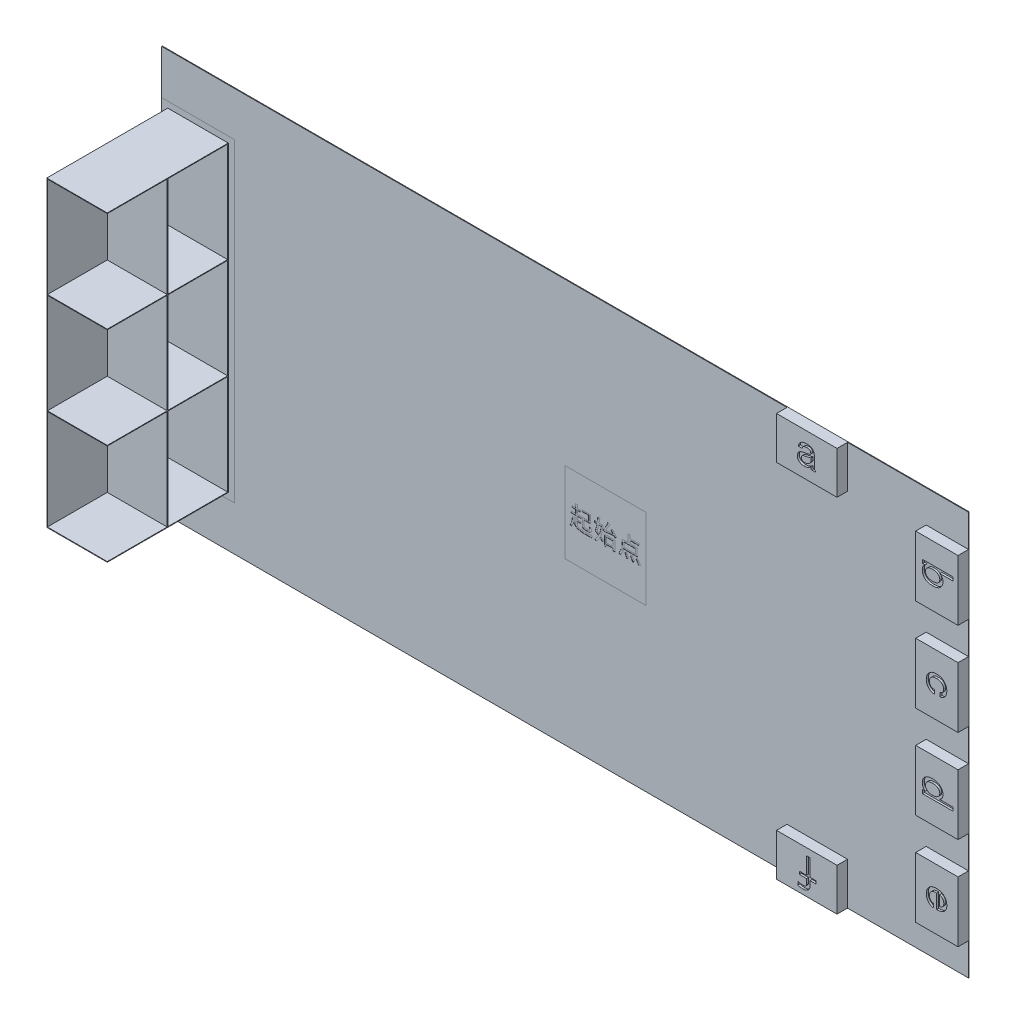
from build123d import *

# Parameters (mm, degrees)
SKETCH_1_W           = 4000
SKETCH_1_H           = 2000
EXTRUDE_1_DEPTH      = 3.5
SKETCH_3_W           = 300
SKETCH_3_H           = 210
SKETCH_3_W_2         = 210
SKETCH_3_H_2         = 300
EXTRUDE_3_DEPTH      = 52
CUT_EXTRUDE_1_DEPTH  = 10
SKETCH_7_W           = 300
SKETCH_7_H           = 1500
EXTRUDE_4_DEPTH      = 3
SKETCH_8_W           = 3
SKETCH_8_H           = 1500
EXTRUDE_5_DEPTH      = 597
SKETCH_9_W           = 297
SKETCH_9_H           = 3
EXTRUDE_6_DEPTH      = 597
SKETCH_10_W          = 3
SKETCH_10_H          = 496
EXTRUDE_7_DEPTH      = 297
SKETCH_11_W          = 3
SKETCH_11_H          = 496
EXTRUDE_8_DEPTH      = 297
CUT_EXTRUDE_3_DEPTH  = 10
CUT_EXTRUDE_4_DEPTH  = 10
CUT_EXTRUDE_5_DEPTH  = 10
CUT_EXTRUDE_6_DEPTH  = 10
CUT_EXTRUDE_7_DEPTH  = 10
SKETCH_17_W          = 32.748538012
SKETCH_17_H          = 23.859649123
SKETCH_17_W_2        = 55.67251462
SKETCH_17_H_2        = 22.456140351
CUT_EXTRUDE_10_DEPTH = 1


with BuildPart() as part:
    # 草图1 → 凸台-拉伸1 (new body)
    with BuildSketch(Plane.XY):
        with Locations((2000, -1000)):
            Rectangle(SKETCH_1_W, SKETCH_1_H)
    extrude(amount=EXTRUDE_1_DEPTH)

    # 草图3 → 凸台-拉伸3 (add)
    with BuildSketch(Plane.XY.offset(3.5)):
        with Locations((3250, -1895)):
            Rectangle(SKETCH_3_W, SKETCH_3_H)
        with Locations((3895, -1690)):
            Rectangle(SKETCH_3_W_2, SKETCH_3_H_2)
        with Locations((3895, -770)):
            Rectangle(SKETCH_3_W_2, SKETCH_3_H_2)
        with Locations((3895, -1230)):
            Rectangle(SKETCH_3_W_2, SKETCH_3_H_2)
        with Locations((3895, -310)):
            Rectangle(SKETCH_3_W_2, SKETCH_3_H_2)
        with Locations((3250, -105)):
            Rectangle(SKETCH_3_W, SKETCH_3_H)
    extrude(amount=EXTRUDE_3_DEPTH)

    # 草图4 → 切除-拉伸1 (cut)
    with BuildSketch(Plane.XY.offset(55.5)):
        with BuildLine():
            Line((3294.736842105, -155.614035088), (3273.684210526, -155.614035088))
            add(Edge.make_bspline(
                [(3273.684210526, -155.614035088), (3273.136967392, -154.944206682), (3271.9651814, -153.509934612), (3270.913720324, -150.652864518), (3270.287106328, -147.206985658), (3270.214568568, -144.690716566), (3270.175438596, -143.333333333)],
                knots=[0, 0, 0, 0, 0.789878128, 1.691328897, 2.754604006, 4, 4, 4, 4], degree=3))
            add(Edge.make_bspline(
                [(3270.175438596, -143.333333333), (3269.116625082, -144.452195958), (3267.014202427, -146.673854539), (3263.433330332, -149.560513858), (3259.50202511, -151.966132532), (3255.283408677, -153.946986679), (3250.838392572, -155.448252453), (3246.276158935, -156.568535296), (3241.594076872, -157.231849271), (3238.436113849, -157.322609206), (3236.842105263, -157.368421053)],
                knots=[0, 0, 0, 0, 0.99108684, 1.967941849, 2.951023905, 3.952360611, 4.962327917, 5.966937013, 6.973794236, 8, 8, 8, 8], degree=3))
            add(Edge.make_bspline(
                [(3236.842105263, -157.368421053), (3235.692795657, -157.357592677), (3233.431579321, -157.336288321), (3230.128394762, -156.934886823), (3226.944920791, -156.457517678), (3223.926423333, -155.645588912), (3221.005985794, -154.699295775), (3218.263550759, -153.429453288), (3215.596792779, -152.06294122), (3213.147941291, -150.38715936), (3210.864793484, -148.573387187), (3208.897451109, -146.49902067), (3207.239001607, -144.245720018), (3205.83771594, -141.818216208), (3204.81855295, -139.169689991), (3204.06056342, -136.339505839), (3203.60544743, -133.319763847), (3203.541449955, -131.238276019), (3203.50877193, -130.175438596)],
                knots=[0, 0, 0, 0, 1.138937901, 2.240810461, 3.296706705, 4.328288106, 5.337028069, 6.337039161, 7.321998526, 8.30502355, 9.274578604, 10.208993102, 11.130541657, 12.044422553, 12.979824152, 13.93596077, 14.946072082, 16, 16, 16, 16], degree=3))
            add(Edge.make_bspline(
                [(3203.50877193, -130.175438596), (3203.528546494, -129.101543494), (3203.567062481, -127.009859952), (3204.018752213, -123.956749428), (3204.676453253, -121.051756092), (3205.670710664, -118.331628801), (3206.859685545, -115.743437587), (3208.42457877, -113.37539631), (3210.195866771, -111.123869928), (3212.274063272, -109.060372832), (3214.632311518, -107.159557288), (3217.303136656, -105.454289283), (3220.26149545, -103.889063916), (3223.501845645, -102.438544412), (3227.091865462, -101.283899859), (3230.94241333, -100.188923472), (3235.099580258, -99.286777282), (3237.987511254, -98.831027141), (3239.473684211, -98.596491228)],
                knots=[0, 0, 0, 0, 0.970200953, 1.889712841, 2.785134063, 3.658547137, 4.503899677, 5.35405909, 6.218090441, 7.090514932, 7.995840025, 8.951904317, 9.950690379, 11.020488193, 12.156911096, 13.356703322, 14.639719563, 16, 16, 16, 16], degree=3))
            add(Edge.make_bspline(
                [(3239.473684211, -98.596491228), (3241.457553464, -98.294562464), (3245.304138028, -97.70914358), (3250.870512135, -96.657688004), (3256.0603643, -95.54981957), (3260.098812599, -94.468490827), (3263.049212632, -93.595565209), (3264.912164215, -92.821737291), (3266.535521289, -92.078448919), (3267.815592915, -91.185476791), (3268.890580486, -90.317592967), (3269.595400379, -89.318955428), (3270.1177749, -88.291566553), (3270.15636524, -87.556359899), (3270.175438596, -87.192982456)],
                knots=[0, 0, 0, 0, 2.107111613, 4.085542931, 5.948146815, 7.677718057, 8.476216546, 9.175223692, 9.795721221, 10.344548113, 10.812061436, 11.235137722, 11.621965202, 12, 12, 12, 12], degree=3))
            add(Edge.make_bspline(
                [(3270.175438596, -87.192982456), (3270.117754739, -86.312040036), (3270.000586649, -84.522660058), (3269.266485866, -81.831921299), (3267.934723409, -79.212588842), (3266.569332289, -77.009596718), (3265.090671325, -75.374885361), (3263.654114832, -74.278950468), (3261.918354867, -73.39385197), (3259.918291787, -72.630376125), (3257.618044085, -72.112996724), (3255.05070606, -71.671952107), (3252.17964861, -71.47334245), (3250.17339541, -71.427509509), (3249.122807018, -71.403508772)],
                knots=[0, 0, 0, 0, 1.061145256, 2.155409969, 3.32744696, 4.58942469, 5.262953509, 5.969609087, 6.751075837, 7.600992533, 8.540118245, 9.583902906, 10.734794012, 12, 12, 12, 12], degree=3))
            add(Edge.make_bspline(
                [(3249.122807018, -71.403508772), (3247.485117964, -71.453222755), (3244.430131043, -71.545960486), (3240.167195265, -72.218805552), (3236.606485691, -73.460973134), (3233.728682099, -75.238257658), (3231.455820693, -77.466898546), (3229.643904725, -80.074959748), (3228.137859709, -83.030302448), (3227.514522329, -85.197744694), (3227.192982456, -86.315789474)],
                knots=[0, 0, 0, 0, 1.349357617, 2.517126105, 3.541790225, 4.435668764, 5.281297301, 6.145416033, 7.043338789, 8, 8, 8, 8], degree=3))
            Line((3227.192982456, -86.315789474), (3207.894736842, -86.315789474))
            add(Edge.make_bspline(
                [(3207.894736842, -86.315789474), (3208.066531351, -85.173975829), (3208.405361867, -82.921975401), (3209.304853479, -79.676137329), (3210.429140558, -76.580710451), (3211.905817654, -73.696602884), (3213.639234248, -70.971391942), (3215.657257206, -68.426833116), (3217.990836079, -66.079865389), (3220.581204768, -63.903410579), (3223.436582039, -61.961230433), (3226.513057407, -60.276369299), (3229.767589445, -58.787211811), (3233.250773755, -57.643973372), (3236.929104644, -56.715357687), (3240.809976548, -56.087282126), (3244.901528556, -55.68250115), (3247.692295211, -55.637236948), (3249.122807018, -55.614035088)],
                knots=[0, 0, 0, 0, 0.976819435, 1.926582151, 2.846303078, 3.760752567, 4.66372935, 5.577350991, 6.504537603, 7.461355947, 8.437960182, 9.422965099, 10.428455749, 11.463610819, 12.52217693, 13.637668652, 14.789098731, 16, 16, 16, 16], degree=3))
            add(Edge.make_bspline(
                [(3249.122807018, -55.614035088), (3250.683395592, -55.633810005), (3253.702454002, -55.672065847), (3258.086754927, -56.113351699), (3262.171273371, -56.779651147), (3265.963479495, -57.705933727), (3269.444436363, -58.953593259), (3272.629298667, -60.469111791), (3275.515565566, -62.270653983), (3278.104148285, -64.326636509), (3280.374269697, -66.636023894), (3282.360434435, -69.168713573), (3284.002904394, -71.941695396), (3285.39210723, -74.915390421), (3286.41516164, -78.119017081), (3287.167765434, -81.533033122), (3287.623150865, -85.166490627), (3287.686768563, -87.668178562), (3287.719298246, -88.947368421)],
                knots=[0, 0, 0, 0, 1.288108676, 2.491928619, 3.634130004, 4.703295623, 5.710185913, 6.682043497, 7.609962811, 8.513477874, 9.405011161, 10.277874372, 11.164235917, 12.060420558, 12.982245169, 13.934656988, 14.943926699, 16, 16, 16, 16], degree=3))
            Line((3287.719298246, -88.947368421), (3287.719298246, -137.192982456))
            add(Edge.make_bspline(
                [(3287.719298246, -137.192982456), (3287.730118733, -138.050374635), (3287.751449695, -139.740594344), (3288.156768126, -142.209256521), (3288.630890499, -144.598761501), (3289.732881808, -147.651164148), (3291.634689355, -151.43114142), (3293.6740556, -154.180990585), (3294.736842105, -155.614035088)],
                knots=[0, 0, 0, 0, 0.765934861, 1.509925364, 2.233966793, 2.941750286, 4.406236969, 6, 6, 6, 6], degree=3))
        make_face()
        with BuildLine():
            Line((3270.175438596, -123.157894737), (3270.175438596, -105.614035088))
            add(Edge.make_bspline(
                [(3270.175438596, -105.614035088), (3268.456166562, -106.174437888), (3265.107599246, -107.265915249), (3260.799426068, -108.54027072), (3256.990570949, -109.469496206), (3253.338176799, -110.14507585), (3248.884800468, -110.984871419), (3245.626763676, -111.4837831), (3243.859649123, -111.754385965)],
                knots=[0, 0, 0, 0, 1.202468659, 2.342007065, 2.986514694, 3.808474686, 4.811346672, 6, 6, 6, 6], degree=3))
            add(Edge.make_bspline(
                [(3243.859649123, -111.754385965), (3242.808057638, -111.909570144), (3240.796219896, -112.206458615), (3237.929015676, -112.746485884), (3235.36134031, -113.399434522), (3233.066732334, -114.108843514), (3231.052272634, -114.89607943), (3229.345381053, -115.825441393), (3227.899015713, -116.78204211), (3226.380169636, -118.171842204), (3224.969409184, -120.13982562), (3223.676253091, -122.683661509), (3222.968074805, -125.492375202), (3222.861407865, -127.432014903), (3222.807017544, -128.421052632)],
                knots=[0, 0, 0, 0, 1.276296596, 2.441729226, 3.50138554, 4.455500742, 5.324768291, 6.092724628, 6.78519533, 7.401851409, 8.553932685, 9.670462712, 10.812150387, 12, 12, 12, 12], degree=3))
            add(Edge.make_bspline(
                [(3222.807017544, -128.421052632), (3222.862280622, -129.269962022), (3222.971955272, -130.954700609), (3223.692803037, -133.408248994), (3224.992334783, -135.653134899), (3226.689310692, -137.756277603), (3228.964579989, -139.488080239), (3231.745349073, -140.748317201), (3235.022818212, -141.432990901), (3237.358822441, -141.528398322), (3238.596491228, -141.578947368)],
                knots=[0, 0, 0, 0, 0.882749856, 1.751898097, 2.628885817, 3.56440472, 4.543936804, 5.571648779, 6.713403652, 8, 8, 8, 8], degree=3))
            add(Edge.make_bspline(
                [(3238.596491228, -141.578947368), (3239.943716896, -141.531356386), (3242.717709475, -141.433364612), (3246.928309438, -140.512398156), (3251.301267909, -139.139912738), (3255.769171971, -137.26631895), (3260.115029746, -134.77306947), (3264.049819658, -131.566064295), (3267.457426598, -127.661573003), (3269.255276084, -124.682581129), (3270.175438596, -123.157894737)],
                knots=[0, 0, 0, 0, 0.843781446, 1.7373804, 2.690966208, 3.716364983, 4.769232083, 5.821310551, 6.884918692, 8, 8, 8, 8], degree=3))
        make_face(mode=Mode.SUBTRACT)
    extrude(amount=-CUT_EXTRUDE_1_DEPTH, mode=Mode.SUBTRACT)

    # 草图7 → 凸台-拉伸4 (add)
    with BuildSketch(Plane.XY.offset(3.5)):
        with Locations((180, -1000)):
            Rectangle(SKETCH_7_W, SKETCH_7_H)
    extrude(amount=EXTRUDE_4_DEPTH)

    # 草图8 → 凸台-拉伸5 (add)
    with BuildSketch(Plane.XY.offset(6.5)):
        with Locations((31.5, -1000)):
            Rectangle(SKETCH_8_W, SKETCH_8_H)
    extrude(amount=EXTRUDE_5_DEPTH)

    # 草图9 → 凸台-拉伸6 (add)
    with BuildSketch(Plane.XY.offset(6.5)):
        with Locations((181.5, -1748.5)):
            Rectangle(SKETCH_9_W, SKETCH_9_H)
        with Locations((181.5, -251.5)):
            Rectangle(SKETCH_9_W, SKETCH_9_H)
        with Locations((181.5, -750.5)):
            Rectangle(SKETCH_9_W, SKETCH_9_H)
        with Locations((181.5, -1249.5)):
            Rectangle(SKETCH_9_W, SKETCH_9_H)
    extrude(amount=EXTRUDE_6_DEPTH)

    # 草图10 → 凸台-拉伸7 (add)
    with BuildSketch(Plane(origin=(33, 0, 0), x_dir=(0, 0, -1), z_dir=(1, 0, 0))):
        with Locations((-305, -1499)):
            Rectangle(SKETCH_10_W, SKETCH_10_H)
    extrude(amount=EXTRUDE_7_DEPTH)

    # 草图11 → 凸台-拉伸8 (add)
    with BuildSketch(Plane(origin=(33, 0, 0), x_dir=(0, 0, -1), z_dir=(1, 0, 0))):
        with Locations((-305, -1000)):
            Rectangle(SKETCH_11_W, SKETCH_11_H)
        with Locations((-305, -501)):
            Rectangle(SKETCH_11_W, SKETCH_11_H)
    extrude(amount=EXTRUDE_8_DEPTH)

    # 草图12 → 切除-拉伸3 (cut)
    with BuildSketch(Plane.XY.offset(55.5)):
        with BuildLine():
            add(Edge.make_bspline(
                [(3873.50877193, -352.98245614), (3871.449427427, -352.949007771), (3867.462707111, -352.8842545), (3861.689428801, -352.274158621), (3856.298805075, -351.371985694), (3851.315499188, -349.989101917), (3846.698621542, -348.284114028), (3842.496240048, -346.164854296), (3838.66530642, -343.689438661), (3835.310908431, -340.775437507), (3832.323642646, -337.636271173), (3829.741663991, -334.299445414), (3827.538870544, -330.802579673), (3825.758763404, -327.124956582), (3824.347310931, -323.29620485), (3823.329898975, -319.303429396), (3822.743574267, -315.139962799), (3822.66918363, -312.308503728), (3822.631578947, -310.877192982)],
                knots=[0, 0, 0, 0, 1.327366024, 2.569670635, 3.739468755, 4.847337081, 5.89914856, 6.907798019, 7.876149193, 8.83195725, 9.765468134, 10.666339033, 11.547869993, 12.425409596, 13.295808262, 14.174763544, 15.077337695, 16, 16, 16, 16], degree=3))
            add(Edge.make_bspline(
                [(3822.631578947, -310.877192982), (3822.676277701, -309.326442357), (3822.763275317, -306.308201412), (3823.405536385, -301.942955977), (3824.516569929, -297.908604916), (3826.055315798, -294.175047914), (3828.09270197, -290.694290408), (3830.738156236, -287.515408718), (3833.874364326, -284.513427512), (3836.295499854, -282.808764515), (3837.543859649, -281.929824561)],
                knots=[0, 0, 0, 0, 1.090645776, 2.122734426, 3.09485886, 4.027157156, 4.956056932, 5.919757797, 6.927407946, 8, 8, 8, 8], degree=3))
            Line((3837.543859649, -281.929824561), (3824.385964912, -281.929824561))
            Line((3824.385964912, -281.929824561), (3824.385964912, -264.385964912))
            Line((3824.385964912, -264.385964912), (3974.385964912, -264.385964912))
            Line((3974.385964912, -264.385964912), (3974.385964912, -281.929824561))
            Line((3974.385964912, -281.929824561), (3909.473684211, -281.929824561))
            add(Edge.make_bspline(
                [(3909.473684211, -281.929824561), (3910.729298202, -282.812349905), (3913.17725334, -284.532928415), (3916.412330669, -287.507599888), (3919.137940359, -290.717857741), (3921.382753952, -294.161184209), (3923.117442192, -297.893009379), (3924.414316749, -301.922700251), (3925.101885644, -306.305359636), (3925.208454577, -309.326433625), (3925.263157895, -310.877192982)],
                knots=[0, 0, 0, 0, 1.066243381, 2.078756672, 3.045758577, 3.987693276, 4.927488752, 5.899082293, 6.921569678, 8, 8, 8, 8], degree=3))
            add(Edge.make_bspline(
                [(3925.263157895, -310.877192982), (3925.228445693, -312.30884113), (3925.159739464, -315.142517486), (3924.530655349, -319.305304335), (3923.48113161, -323.297151416), (3922.041653441, -327.133257566), (3920.193595192, -330.813685111), (3917.888666493, -334.301200311), (3915.21068398, -337.638375976), (3912.125813201, -340.776921773), (3908.674286334, -343.692172041), (3904.752593571, -346.157332827), (3900.488487705, -348.277475579), (3895.822667661, -349.995911759), (3890.792627686, -351.366404798), (3885.360738761, -352.275133801), (3879.565455633, -352.882758244), (3875.56806234, -352.94855856), (3873.50877193, -352.98245614)],
                knots=[0, 0, 0, 0, 0.915219549, 1.811503757, 2.685100406, 3.550891634, 4.427503435, 5.313126188, 6.219602575, 7.16000331, 8.12398321, 9.10197019, 10.114873405, 11.164686594, 12.276982707, 13.444166905, 14.683341318, 16, 16, 16, 16], degree=3))
        make_face()
        with BuildLine():
            add(Edge.make_bspline(
                [(3873.50877193, -333.684210526), (3874.863454038, -333.671093183), (3877.501170523, -333.645552259), (3881.336001802, -333.286571988), (3884.972164314, -332.844055446), (3888.368637189, -332.065453084), (3891.576056104, -331.184743815), (3894.539487252, -330.038141401), (3897.28641463, -328.696798438), (3899.832962754, -327.186061024), (3902.109188174, -325.437904661), (3904.092084008, -323.465360801), (3905.751255591, -321.271735583), (3907.134935967, -318.889066248), (3908.171297644, -316.290518544), (3908.92061859, -313.499854764), (3909.379136865, -310.502327817), (3909.44161632, -308.431357085), (3909.473684211, -307.368421053)],
                knots=[0, 0, 0, 0, 1.288137047, 2.508145861, 3.662076377, 4.769447511, 5.819456428, 6.823900875, 7.786860735, 8.725033561, 9.63582574, 10.50999044, 11.377451791, 12.245096648, 13.123198365, 14.030370945, 14.989078088, 16, 16, 16, 16], degree=3))
            add(Edge.make_bspline(
                [(3909.473684211, -307.368421053), (3909.441927685, -306.499842503), (3909.379554606, -304.793864962), (3908.899794419, -302.286431958), (3908.163316805, -299.882020727), (3907.1019876, -297.567453579), (3905.726576297, -295.361934917), (3904.067920757, -293.240509083), (3902.078700761, -291.244766817), (3899.826091135, -289.34100612), (3897.302396401, -287.60107672), (3894.562240351, -286.050674673), (3891.572678815, -284.80389784), (3888.390563866, -283.710413014), (3884.968578277, -282.923508966), (3881.34593849, -282.324305534), (3877.499244965, -282.018420144), (3874.862898057, -281.959888564), (3873.50877193, -281.929824561)],
                knots=[0, 0, 0, 0, 0.849923304, 1.669336722, 2.491010972, 3.307124725, 4.154597246, 5.030642041, 5.937894961, 6.908608511, 7.914530789, 8.93515504, 9.98494042, 11.08140083, 12.225875366, 13.41822216, 14.673902582, 16, 16, 16, 16], degree=3))
            add(Edge.make_bspline(
                [(3873.50877193, -281.929824561), (3872.154589977, -281.959361561), (3869.528923292, -282.016631794), (3865.693731842, -282.327966172), (3862.101389135, -282.915601297), (3858.7233821, -283.710619517), (3855.607109535, -284.804949474), (3852.686776614, -286.042355494), (3850.040280126, -287.605282659), (3847.609710752, -289.328783924), (3845.488032709, -291.26805117), (3843.559302312, -293.229252903), (3842.005310665, -295.374391611), (3840.697184192, -297.576284723), (3839.661707414, -299.882812465), (3838.972980831, -302.292183555), (3838.472122893, -304.792136456), (3838.438278289, -306.499457522), (3838.421052632, -307.368421053)],
                knots=[0, 0, 0, 0, 1.34368037, 2.60530483, 3.813461154, 4.952217799, 6.042873598, 7.086862092, 8.093013899, 9.085942625, 10.037069905, 10.941413864, 11.809548431, 12.657163182, 13.47968907, 14.309132639, 15.139410799, 16, 16, 16, 16], degree=3))
            add(Edge.make_bspline(
                [(3838.421052632, -307.368421053), (3838.438442303, -308.431711803), (3838.472331169, -310.50384523), (3838.952898994, -313.494638016), (3839.654265168, -316.289579907), (3840.665496226, -318.879965311), (3841.981945745, -321.257945811), (3843.53533619, -323.475558681), (3845.456101296, -325.413392241), (3847.603840646, -327.197622423), (3850.056210151, -328.693297325), (3852.710712471, -330.046430853), (3855.603575377, -331.183654436), (3858.745685384, -332.065630269), (3862.098023183, -332.851149822), (3865.703619852, -333.283226296), (3869.527004041, -333.647238879), (3872.154033817, -333.671631466), (3873.50877193, -333.684210526)],
                knots=[0, 0, 0, 0, 1.023594965, 1.994774564, 2.91107866, 3.796738931, 4.66545106, 5.525595552, 6.396498952, 7.286452912, 8.210155985, 9.157607316, 10.155666289, 11.199281991, 12.300679809, 13.469622572, 14.695104724, 16, 16, 16, 16], degree=3))
        make_face(mode=Mode.SUBTRACT)
    extrude(amount=-CUT_EXTRUDE_3_DEPTH, mode=Mode.SUBTRACT)

    # 草图13 → 切除-拉伸4 (cut)
    with BuildSketch(Plane.XY.offset(55.5)):
        with BuildLine():
            add(Edge.make_bspline(
                [(3883.859649123, -813.859649123), (3882.363395656, -813.822743225), (3879.424061235, -813.750242959), (3875.120015446, -813.164096808), (3871.039017746, -812.151844895), (3867.1798029, -810.753705891), (3863.545032072, -808.947552572), (3860.120421093, -806.764746192), (3856.908466042, -804.179986156), (3853.980424749, -801.194750685), (3851.320563291, -797.916519032), (3848.983237517, -794.419632494), (3846.998427826, -790.702456754), (3845.439254411, -786.767156999), (3844.130608797, -782.65136348), (3843.294761242, -778.31056455), (3842.700933051, -773.785112566), (3842.654968379, -770.695153404), (3842.631578947, -769.122807018)],
                knots=[0, 0, 0, 0, 1.052142471, 2.066894847, 3.047865912, 4.004492656, 4.948081861, 5.896821968, 6.855629614, 7.841291453, 8.832236806, 9.820925445, 10.795458201, 11.789822784, 12.794490735, 13.828219499, 14.894874966, 16, 16, 16, 16], degree=3))
            add(Edge.make_bspline(
                [(3842.631578947, -769.122807018), (3842.680057538, -767.539913915), (3842.775723441, -764.416289716), (3843.391965751, -759.808025686), (3844.473004087, -755.370075964), (3845.972885185, -751.107874231), (3847.872736779, -746.997977411), (3850.213055518, -743.06674356), (3853.015807406, -739.315644347), (3856.156146307, -735.71642616), (3859.723010477, -732.455263714), (3863.603713866, -729.561720155), (3867.835265253, -727.155073109), (3872.36173639, -725.163782158), (3877.213526064, -723.641692717), (3882.366871782, -722.535431253), (3887.839224707, -721.887124636), (3891.590213618, -721.799304346), (3893.50877193, -721.754385965)],
                knots=[0, 0, 0, 0, 0.975270693, 1.924564037, 2.858324569, 3.784713695, 4.704156615, 5.643621005, 6.597779193, 7.585748668, 8.582153659, 9.569672418, 10.56195835, 11.574781948, 12.6108764, 13.689227813, 14.8180847, 16, 16, 16, 16], degree=3))
            add(Edge.make_bspline(
                [(3893.50877193, -721.754385965), (3895.427331069, -721.799303441), (3899.1783216, -721.887121963), (3904.650662973, -722.535441198), (3909.80404975, -723.641657813), (3914.655694268, -725.163905812), (3919.182687603, -727.154626348), (3923.412339767, -729.563347976), (3927.293683751, -732.444438015), (3930.829115018, -735.728037064), (3933.969822995, -739.314539237), (3936.774417265, -743.065828178), (3939.104674871, -747.00655547), (3941.05276598, -751.099039443), (3942.541933218, -755.371293019), (3943.626287846, -759.807694296), (3944.241636055, -764.416375799), (3944.337424317, -767.539942867), (3944.385964912, -769.122807018)],
                knots=[0, 0, 0, 0, 1.182068696, 2.311072093, 3.389563461, 4.425792384, 5.438747432, 6.431162149, 7.418809073, 8.410438235, 9.398535934, 10.352817958, 11.292404278, 12.214795102, 13.141304461, 14.075186182, 15.02460273, 16, 16, 16, 16], degree=3))
            add(Edge.make_bspline(
                [(3944.385964912, -769.122807018), (3944.352362626, -770.693970857), (3944.286865589, -773.756458154), (3943.847952568, -778.227208466), (3943.020967145, -782.438571716), (3941.91457848, -786.414179811), (3940.54945084, -790.171926675), (3938.755371436, -793.630959026), (3936.711257004, -796.877378079), (3934.350900515, -799.834036553), (3931.779851883, -802.505376433), (3929.067559147, -804.844849103), (3926.220457587, -806.809982116), (3923.259156723, -808.421225492), (3920.174465862, -809.709774045), (3916.934761151, -810.557642646), (3913.598110469, -811.157503585), (3911.326127755, -811.204345958), (3910.175438596, -811.228070175)],
                knots=[0, 0, 0, 0, 1.24479578, 2.426335921, 3.553709689, 4.640321044, 5.693704062, 6.714363762, 7.721154073, 8.728784852, 9.705703316, 10.654914324, 11.561646866, 12.440846273, 13.321927485, 14.202340072, 15.0895407, 16, 16, 16, 16], degree=3))
            Line((3910.175438596, -811.228070175), (3910.175438596, -791.929824561))
            add(Edge.make_bspline(
                [(3910.175438596, -791.929824561), (3911.022432384, -791.848929898), (3912.652232111, -791.693271023), (3914.981965347, -791.19994408), (3917.102434691, -790.516972379), (3919.030158807, -789.670067162), (3920.777091767, -788.675893167), (3922.276361308, -787.44756679), (3923.608825391, -786.084679506), (3925.018822994, -783.95724777), (3926.432405877, -781.055716795), (3927.737047382, -777.33443176), (3928.437714528, -773.307412043), (3928.542569162, -770.543938371), (3928.596491228, -769.122807018)],
                knots=[0, 0, 0, 0, 0.928504302, 1.786643632, 2.594417402, 3.35686042, 4.082946407, 4.781048227, 5.466923859, 6.155749507, 7.557201584, 8.982007855, 10.447981138, 12, 12, 12, 12], degree=3))
            add(Edge.make_bspline(
                [(3928.596491228, -769.122807018), (3928.571128915, -768.255110432), (3928.520465634, -766.521816011), (3928.124396348, -763.961005852), (3927.45615355, -761.451608482), (3926.55980699, -758.996090699), (3925.370138487, -756.590503856), (3923.899866625, -754.267767822), (3922.202932311, -751.980320364), (3920.26554133, -749.765448819), (3918.02989927, -747.712876242), (3915.45935373, -745.901416833), (3912.561473034, -744.385901088), (3909.35574322, -743.150288043), (3905.835691126, -742.211544696), (3902.008356946, -741.549595708), (3897.861546263, -741.110397957), (3894.993623431, -741.072337285), (3893.50877193, -741.052631579)],
                knots=[0, 0, 0, 0, 0.824792641, 1.647590307, 2.456809628, 3.290806688, 4.128925408, 5.00320454, 5.901116289, 6.834916893, 7.797015801, 8.779776886, 9.816152827, 10.898469709, 12.040002895, 13.274145698, 14.588703711, 16, 16, 16, 16], degree=3))
            add(Edge.make_bspline(
                [(3893.50877193, -741.052631579), (3892.02389584, -741.072281618), (3889.155925516, -741.110234772), (3885.009445616, -741.550181392), (3881.18097509, -742.209557774), (3877.654976953, -743.159587385), (3874.436010904, -744.36697966), (3871.549340439, -745.922404974), (3868.957662529, -747.700529657), (3866.719880861, -749.766658011), (3864.784409957, -751.981486113), (3863.079612422, -754.257705346), (3861.652922851, -756.600579266), (3860.455623342, -758.994787593), (3859.561936279, -761.451945102), (3858.893001091, -763.960915576), (3858.497115188, -766.521838801), (3858.446427275, -768.255118035), (3858.421052632, -769.122807018)],
                knots=[0, 0, 0, 0, 1.410984783, 2.725252643, 3.959123042, 5.100404265, 6.192087046, 7.21914212, 8.210117531, 9.172004081, 10.105598574, 11.003312133, 11.871985942, 12.70991967, 13.543732647, 14.352773355, 15.17538941, 16, 16, 16, 16], degree=3))
            add(Edge.make_bspline(
                [(3858.421052632, -769.122807018), (3858.491298651, -770.937937235), (3858.626168105, -774.422912253), (3859.783509375, -779.388997443), (3861.696872739, -783.821873099), (3863.995126046, -787.023850877), (3866.171271695, -789.243313096), (3868.078556231, -790.644209485), (3870.144864097, -791.905172511), (3872.491438871, -792.855121379), (3875.0167848, -793.65688455), (3877.782663287, -794.134251488), (3880.74016147, -794.532973557), (3882.796752538, -794.55171663), (3883.859649123, -794.561403509)],
                knots=[0, 0, 0, 0, 1.591581877, 3.055771442, 4.447569418, 5.803455004, 6.489068521, 7.167793937, 7.875330812, 8.608027069, 9.383794086, 10.196647602, 11.067983356, 12, 12, 12, 12], degree=3))
            Line((3883.859649123, -794.561403509), (3883.859649123, -813.859649123))
        make_face()
    extrude(amount=-CUT_EXTRUDE_4_DEPTH, mode=Mode.SUBTRACT)

    # 草图14 → 切除-拉伸5 (cut)
    with BuildSketch(Plane.XY.offset(55.5)):
        with BuildLine():
            Line((3824.385964912, -1270.350877193), (3824.385964912, -1252.807017544))
            Line((3824.385964912, -1252.807017544), (3837.543859649, -1252.807017544))
            add(Edge.make_bspline(
                [(3837.543859649, -1252.807017544), (3836.293005628, -1251.930558479), (3833.860903403, -1250.226412348), (3830.760578189, -1247.189752968), (3828.08113298, -1244.041603092), (3826.057257013, -1240.560121795), (3824.51602546, -1236.828706261), (3823.405694048, -1232.793750298), (3822.763232245, -1228.4286778), (3822.676263082, -1225.410412343), (3822.631578947, -1223.859649123)],
                knots=[0, 0, 0, 0, 1.072676972, 2.08566308, 3.043550697, 3.972524014, 4.90489612, 5.877097517, 6.909267877, 8, 8, 8, 8], degree=3))
            add(Edge.make_bspline(
                [(3822.631578947, -1223.859649123), (3822.669315543, -1222.428390295), (3822.743967136, -1219.597033928), (3823.328383993, -1215.432816459), (3824.355340779, -1211.432934622), (3825.742448254, -1207.594005096), (3827.549449771, -1203.92851938), (3829.740175873, -1200.436693787), (3832.324079047, -1197.10081918), (3835.310715626, -1193.961136492), (3838.665632569, -1191.048241995), (3842.495098218, -1188.568812322), (3846.706567873, -1186.463612551), (3851.302135397, -1184.69585088), (3856.305986327, -1183.379265927), (3861.688152604, -1182.458350354), (3867.463060299, -1181.853786802), (3871.449547726, -1181.788242791), (3873.50877193, -1181.754385965)],
                knots=[0, 0, 0, 0, 0.922608481, 1.825129979, 2.704033986, 3.58093884, 4.452154518, 5.333634053, 6.234452398, 7.167908826, 8.123661124, 9.091955808, 10.100546426, 11.154773517, 12.260749391, 13.430479269, 14.672711409, 16, 16, 16, 16], degree=3))
            add(Edge.make_bspline(
                [(3873.50877193, -1181.754385965), (3875.567944952, -1181.78868651), (3879.565110377, -1181.855269041), (3885.361994551, -1182.457397485), (3890.785538861, -1183.38481593), (3895.835936075, -1184.688963839), (3900.480563262, -1186.470351882), (3904.753743578, -1188.576286821), (3908.67395667, -1191.045522613), (3912.126010507, -1193.959645501), (3915.21023378, -1197.098728169), (3917.890200514, -1200.434893427), (3920.182730489, -1203.917740365), (3922.058282197, -1207.585345239), (3923.472950597, -1211.4321294), (3924.532191459, -1215.430916879), (3925.159341771, -1219.594485365), (3925.228312208, -1222.42805493), (3925.263157895, -1223.859649123)],
                knots=[0, 0, 0, 0, 1.316579806, 2.555679986, 3.722794263, 4.833232486, 5.885424625, 6.898267162, 7.876195554, 8.840117707, 9.780462106, 10.68688419, 11.572453888, 12.442835022, 13.315060447, 14.188604763, 15.084835278, 16, 16, 16, 16], degree=3))
            add(Edge.make_bspline(
                [(3925.263157895, -1223.859649123), (3925.20846881, -1225.410421206), (3925.101927604, -1228.431519984), (3924.41416227, -1232.81400374), (3923.117982795, -1236.844316056), (3921.380803763, -1240.573914315), (3919.149827684, -1244.018642684), (3916.389870881, -1247.196815191), (3913.190553903, -1250.20716505), (3910.731763057, -1251.927024513), (3909.473684211, -1252.807017544)],
                knots=[0, 0, 0, 0, 1.078514287, 2.101081282, 3.07275047, 4.012619117, 4.954627154, 5.915970377, 6.933673602, 8, 8, 8, 8], degree=3))
            Line((3909.473684211, -1252.807017544), (3974.385964912, -1252.807017544))
            Line((3974.385964912, -1252.807017544), (3974.385964912, -1270.350877193))
            Line((3974.385964912, -1270.350877193), (3824.385964912, -1270.350877193))
        make_face()
        with BuildLine():
            add(Edge.make_bspline(
                [(3873.50877193, -1252.807017544), (3874.86293904, -1252.777066139), (3877.499365738, -1252.718753775), (3881.345494648, -1252.411317149), (3884.970125458, -1251.817583897), (3888.381813101, -1251.012291736), (3891.589326051, -1249.986047956), (3894.543261681, -1248.668576386), (3897.313573677, -1247.178056242), (3899.82267639, -1245.423428486), (3902.091261558, -1243.526402696), (3904.057178424, -1241.496555638), (3905.728088223, -1239.376403981), (3907.10160471, -1237.169009469), (3908.163418494, -1234.854922049), (3908.899767341, -1232.45038334), (3909.379561662, -1229.942984128), (3909.441930066, -1228.237001959), (3909.473684211, -1227.368421053)],
                knots=[0, 0, 0, 0, 1.325820769, 2.581239232, 3.77333728, 4.917573057, 6.010467789, 7.064255209, 8.079532291, 9.085244714, 10.055755755, 10.970407447, 11.846269482, 12.693565204, 13.5095087, 14.331011534, 15.150254006, 16, 16, 16, 16], degree=3))
            add(Edge.make_bspline(
                [(3909.473684211, -1227.368421053), (3909.441628628, -1226.305475453), (3909.379173154, -1224.234486082), (3908.920485178, -1221.237091041), (3908.171762469, -1218.445962256), (3907.13326761, -1215.849072658), (3905.761710632, -1213.467798029), (3904.080118466, -1211.302655531), (3902.11205304, -1209.328100555), (3899.822856711, -1207.588636293), (3897.296914118, -1206.033858823), (3894.538106799, -1204.700364779), (3891.575828058, -1203.554750964), (3888.373384811, -1202.65870673), (3884.964382329, -1201.947599311), (3881.33994347, -1201.434647033), (3877.50050339, -1201.095582535), (3874.86322767, -1201.067205498), (3873.50877193, -1201.052631579)],
                knots=[0, 0, 0, 0, 1.011146281, 1.970066203, 2.877440126, 3.755736733, 4.623574159, 5.483051432, 6.357410148, 7.268404472, 8.212145001, 9.175318586, 10.179985963, 11.230227924, 12.335685781, 13.491297469, 14.711577058, 16, 16, 16, 16], degree=3))
            add(Edge.make_bspline(
                [(3873.50877193, -1201.052631579), (3872.154263555, -1201.066677707), (3869.527679275, -1201.093915145), (3865.699664595, -1201.438025915), (3862.105913366, -1201.940509564), (3858.740881142, -1202.658674928), (3855.603795859, -1203.555815258), (3852.712133126, -1204.692058952), (3850.045528427, -1206.037725197), (3847.613987521, -1207.576546172), (3845.45325998, -1209.35275138), (3843.547274818, -1211.291925572), (3841.971598519, -1213.48213398), (3840.667174277, -1215.858106079), (3839.653795497, -1218.446918132), (3838.953034318, -1221.242303223), (3838.472294338, -1224.232969894), (3838.438429812, -1226.305121152), (3838.421052632, -1227.368421053)],
                knots=[0, 0, 0, 0, 1.305194009, 2.530956715, 3.701610701, 4.801032957, 5.844887578, 6.843175039, 7.790843273, 8.720342915, 9.610500615, 10.481603394, 11.333480864, 12.202391871, 13.088254898, 14.004768766, 14.9761707, 16, 16, 16, 16], degree=3))
            add(Edge.make_bspline(
                [(3838.421052632, -1227.368421053), (3838.438275832, -1228.237386933), (3838.47211561, -1229.944712616), (3838.973008759, -1232.444631839), (3839.661603047, -1234.854129461), (3840.697575232, -1237.160183379), (3842.003785672, -1239.363909049), (3843.569902763, -1241.508283776), (3845.475663395, -1243.502513892), (3847.613113833, -1245.435808522), (3850.028920952, -1247.17348019), (3852.706084538, -1248.677376093), (3855.590169712, -1249.98477345), (3858.732284652, -1251.012192966), (3862.099782603, -1251.825558139), (3865.69419166, -1252.407640237), (3869.528797366, -1252.72054872), (3872.154547129, -1252.777595691), (3873.50877193, -1252.807017544)],
                knots=[0, 0, 0, 0, 0.860407418, 1.690510198, 2.519778563, 3.342130708, 4.189566417, 5.057517607, 5.969485099, 6.920411471, 7.91313046, 8.913721863, 9.961847277, 11.048828262, 12.187344366, 13.39524549, 14.656603456, 16, 16, 16, 16], degree=3))
        make_face(mode=Mode.SUBTRACT)
    extrude(amount=-CUT_EXTRUDE_5_DEPTH, mode=Mode.SUBTRACT)

    # 草图15 → 切除-拉伸6 (cut)
    with BuildSketch(Plane.XY.offset(55.5)):
        with BuildLine():
            add(Edge.make_bspline(
                [(3877.719298246, -1733.859649123), (3876.426571581, -1733.676484341), (3873.89540203, -1733.317846177), (3870.210934615, -1732.400776259), (3866.730489879, -1731.129152326), (3863.42969261, -1729.532340819), (3860.328603721, -1727.602462946), (3857.410323561, -1725.349805875), (3854.725402661, -1722.733366746), (3852.222252823, -1719.844153136), (3849.980753892, -1716.729027383), (3848.006092982, -1713.450707461), (3846.345918664, -1710.024493406), (3844.981860686, -1706.460618219), (3843.936162209, -1702.750975176), (3843.197129204, -1698.914472057), (3842.728610622, -1694.938931507), (3842.664207338, -1692.243014931), (3842.631578947, -1690.877192982)],
                knots=[0, 0, 0, 0, 1.027349721, 2.01155929, 2.982460583, 3.939488989, 4.892865183, 5.852926488, 6.835695019, 7.838993092, 8.858780706, 9.852982506, 10.848134193, 11.851939219, 12.853170615, 13.878076749, 14.924978104, 16, 16, 16, 16], degree=3))
            add(Edge.make_bspline(
                [(3842.631578947, -1690.877192982), (3842.680214901, -1689.164534539), (3842.775957787, -1685.793060356), (3843.38290025, -1680.84905602), (3844.464077116, -1676.139653673), (3845.961148347, -1671.680480774), (3847.857439625, -1667.436638379), (3850.199072425, -1663.438077271), (3852.989047536, -1659.681551897), (3856.162498082, -1656.171983409), (3859.723794607, -1653.00198031), (3863.616822078, -1650.213805166), (3867.836368824, -1647.865131016), (3872.371096824, -1645.950498936), (3877.214131232, -1644.452256703), (3882.36868886, -1643.379235448), (3887.841253291, -1642.773105441), (3891.590477566, -1642.679481653), (3893.50877193, -1642.631578947)],
                knots=[0, 0, 0, 0, 1.040797168, 2.048873666, 3.021084232, 3.972127882, 4.902919553, 5.840849159, 6.781936359, 7.741660759, 8.711172562, 9.67355567, 10.645766236, 11.639499165, 12.659427629, 13.721641773, 14.834275726, 16, 16, 16, 16], degree=3))
            add(Edge.make_bspline(
                [(3893.50877193, -1642.631578947), (3895.427067113, -1642.67948073), (3899.17629299, -1642.773102714), (3904.648846002, -1643.379245583), (3909.803444177, -1644.452221167), (3914.646335499, -1645.95062457), (3919.181576313, -1647.864679022), (3923.399265088, -1650.215445969), (3927.292560504, -1652.991206911), (3930.823117914, -1656.183556791), (3933.996590986, -1659.680405142), (3936.788335004, -1663.437243083), (3939.119937747, -1667.444957323), (3941.06487458, -1671.671754608), (3942.550730025, -1676.140891428), (3943.635409755, -1680.84870951), (3944.241384285, -1685.79315162), (3944.337260984, -1689.164565283), (3944.385964912, -1690.877192982)],
                knots=[0, 0, 0, 0, 1.165883549, 2.278669524, 3.341028802, 4.36109662, 5.354965325, 6.327308727, 7.289823328, 8.254563191, 9.21441872, 10.155634504, 11.093692261, 12.027329397, 12.97850299, 13.950846391, 14.959060625, 16, 16, 16, 16], degree=3))
            add(Edge.make_bspline(
                [(3944.385964912, -1690.877192982), (3944.348334696, -1692.384364711), (3944.274707692, -1695.333285825), (3943.703176797, -1699.648866032), (3942.813986242, -1703.758370626), (3941.496486099, -1707.665592212), (3939.803501448, -1711.357641135), (3937.7796353, -1714.875929657), (3935.363597982, -1718.168410268), (3932.563214798, -1721.227317948), (3929.356903595, -1724.047181587), (3925.616028062, -1726.430779469), (3921.436094822, -1728.490504896), (3916.764917218, -1730.139990369), (3911.631317355, -1731.430759297), (3906.009431492, -1732.316521589), (3899.920296002, -1732.874719378), (3895.697640176, -1732.945675248), (3893.50877193, -1732.98245614)],
                knots=[0, 0, 0, 0, 0.961708122, 1.881671036, 2.773870087, 3.641663089, 4.507775147, 5.362587133, 6.228064545, 7.108728611, 8.005441503, 8.944907831, 9.931047604, 10.97398463, 12.100587867, 13.305158731, 14.603094184, 16, 16, 16, 16], degree=3))
            Line((3893.50877193, -1732.98245614), (3893.50877193, -1661.929824561))
            add(Edge.make_bspline(
                [(3893.50877193, -1661.929824561), (3891.959256613, -1661.952748264), (3888.974082751, -1661.996911259), (3884.674840658, -1662.388858764), (3880.729195659, -1663.02505832), (3877.1380794, -1663.928482912), (3873.881597164, -1665.090634233), (3870.994911672, -1666.549801093), (3868.443567678, -1668.243793599), (3866.290349948, -1670.225808541), (3864.436897626, -1672.379000122), (3862.84903936, -1674.667227302), (3861.460050891, -1677.044679208), (3860.354564136, -1679.577981788), (3859.477912339, -1682.230620614), (3858.861248924, -1685.005930397), (3858.499077771, -1687.900278878), (3858.447477471, -1689.868998995), (3858.421052632, -1690.877192982)],
                knots=[0, 0, 0, 0, 1.434885359, 2.764336837, 3.994463084, 5.13297266, 6.189581215, 7.189893396, 8.121842511, 9.016503945, 9.891207595, 10.748250382, 11.592996704, 12.437266509, 13.303184754, 14.17679506, 15.066325252, 16, 16, 16, 16], degree=3))
            add(Edge.make_bspline(
                [(3858.421052632, -1690.877192982), (3858.468202371, -1692.420339808), (3858.558771153, -1695.384532879), (3859.499751456, -1699.60594681), (3860.98054759, -1703.407873459), (3863.126683649, -1706.749325002), (3865.894257067, -1709.589743731), (3869.299809372, -1711.852664538), (3873.274969647, -1713.608869325), (3876.198092163, -1714.235369832), (3877.719298246, -1714.561403509)],
                knots=[0, 0, 0, 0, 1.098641888, 2.110354387, 3.066720321, 3.994127016, 4.922369068, 5.873233211, 6.893221014, 8, 8, 8, 8], degree=3))
            Line((3877.719298246, -1714.561403509), (3877.719298246, -1733.859649123))
        make_face()
        with BuildLine():
            add(Edge.make_bspline(
                [(3907.543859649, -1712.807017544), (3908.530804478, -1712.642109377), (3910.437678444, -1712.323490665), (3913.17228538, -1711.727129125), (3915.671761519, -1710.940260371), (3917.925355569, -1710.001173252), (3919.976765388, -1708.966857683), (3921.76808426, -1707.768006468), (3923.315012267, -1706.411807943), (3925.09802986, -1704.463428674), (3926.869642893, -1701.641543273), (3928.40592074, -1697.861114972), (3929.332640531, -1693.628580488), (3929.42539606, -1690.665417557), (3929.473684211, -1689.122807018)],
                knots=[0, 0, 0, 0, 0.998024439, 1.928280856, 2.789163159, 3.607594607, 4.361234397, 5.077243529, 5.750938548, 6.408507414, 7.705870388, 9.047793964, 10.463093576, 12, 12, 12, 12], degree=3))
            add(Edge.make_bspline(
                [(3929.473684211, -1689.122807018), (3929.421899023, -1687.688452801), (3929.319976003, -1684.86537307), (3928.378530623, -1680.749230387), (3926.823767523, -1676.883893119), (3925.082741959, -1673.84281861), (3923.314121551, -1671.608462341), (3921.774050359, -1669.991659659), (3919.98315017, -1668.504485128), (3917.943052098, -1667.132431021), (3915.679537518, -1665.878031598), (3913.179201928, -1664.734323497), (3910.453233985, -1663.697876873), (3908.533054514, -1663.10991204), (3907.543859649, -1662.807017544)],
                knots=[0, 0, 0, 0, 1.38546136, 2.726849364, 4.056908428, 5.403884468, 6.097307335, 6.808297877, 7.559120176, 8.343303067, 9.182404949, 10.058585078, 10.999865533, 12, 12, 12, 12], degree=3))
            Line((3907.543859649, -1662.807017544), (3907.543859649, -1712.807017544))
        make_face(mode=Mode.SUBTRACT)
    extrude(amount=-CUT_EXTRUDE_6_DEPTH, mode=Mode.SUBTRACT)

    # 草图16 → 切除-拉伸7 (cut)
    with BuildSketch(Plane.XY.offset(55.5)):
        with BuildLine():
            add(Edge.make_bspline(
                [(3206.140350877, -1954.210526316), (3206.902142337, -1954.646778928), (3208.467916984, -1955.54344595), (3211.017699899, -1956.652919867), (3213.758362381, -1957.700276347), (3216.742110946, -1958.657704139), (3220.066786148, -1959.469483074), (3223.815868976, -1959.927998052), (3227.986003455, -1960.326765838), (3230.917117392, -1960.342575897), (3232.456140351, -1960.350877193)],
                knots=[0, 0, 0, 0, 0.769362126, 1.581335281, 2.435061011, 3.342166352, 4.328131654, 5.43087322, 6.651043533, 8, 8, 8, 8], degree=3))
            add(Edge.make_bspline(
                [(3232.456140351, -1960.350877193), (3233.225459735, -1960.341018089), (3234.713646946, -1960.321946435), (3236.84714748, -1960.104004979), (3238.787184739, -1959.698739507), (3240.544912977, -1959.21030403), (3242.092103525, -1958.502275424), (3243.47606807, -1957.703269418), (3244.666021792, -1956.717428205), (3245.958432692, -1955.178368538), (3247.214658886, -1952.991962269), (3248.341278747, -1950.13792212), (3248.995771469, -1946.994667863), (3249.079470551, -1944.813528454), (3249.122807018, -1943.684210526)],
                knots=[0, 0, 0, 0, 1.022121635, 1.977213074, 2.843628151, 3.654101214, 4.394890909, 5.098254803, 5.772609153, 6.435972487, 7.758791262, 9.102962856, 10.50001519, 12, 12, 12, 12], degree=3))
            Line((3249.122807018, -1943.684210526), (3249.122807018, -1922.631578947))
            Line((3249.122807018, -1922.631578947), (3213.157894737, -1922.631578947))
            Line((3213.157894737, -1922.631578947), (3213.157894737, -1908.596491228))
            Line((3213.157894737, -1908.596491228), (3249.122807018, -1908.596491228))
            Line((3249.122807018, -1908.596491228), (3249.122807018, -1824.385964912))
            Line((3249.122807018, -1824.385964912), (3266.666666667, -1824.385964912))
            Line((3266.666666667, -1824.385964912), (3266.666666667, -1908.596491228))
            Line((3266.666666667, -1908.596491228), (3296.49122807, -1908.596491228))
            Line((3296.49122807, -1908.596491228), (3296.49122807, -1922.631578947))
            Line((3296.49122807, -1922.631578947), (3266.666666667, -1922.631578947))
            Line((3266.666666667, -1922.631578947), (3266.666666667, -1942.807017544))
            add(Edge.make_bspline(
                [(3266.666666667, -1942.807017544), (3266.635021656, -1944.086346764), (3266.573399945, -1946.577559584), (3266.10735289, -1950.209015122), (3265.368690074, -1953.626132827), (3264.33682197, -1956.837540992), (3262.961736308, -1959.809085435), (3261.286278925, -1962.559782654), (3259.336164166, -1965.119169278), (3257.055649262, -1967.407569342), (3254.54801812, -1969.460605721), (3251.834932671, -1971.249805608), (3248.944949903, -1972.801762168), (3245.817643622, -1973.976810782), (3242.536834285, -1974.9777169), (3239.049899205, -1975.631842377), (3235.381095415, -1976.082062706), (3232.869140459, -1976.120571796), (3231.578947368, -1976.140350877)],
                knots=[0, 0, 0, 0, 1.121445592, 2.183769112, 3.204409741, 4.183296477, 5.134956096, 6.068055231, 7.002457881, 7.94917822, 8.893848812, 9.83928262, 10.794960191, 11.763010722, 12.763443062, 13.79881788, 14.869426398, 16, 16, 16, 16], degree=3))
            add(Edge.make_bspline(
                [(3231.578947368, -1976.140350877), (3230.051871375, -1976.116543476), (3227.158379255, -1976.071433391), (3223.067214327, -1975.875364999), (3219.468489853, -1975.443609217), (3215.422667912, -1974.73966174), (3211.002168987, -1973.539833356), (3207.70314416, -1972.328304019), (3206.140350877, -1971.754385965)],
                knots=[0, 0, 0, 0, 1.057793878, 2.004299892, 2.835084115, 3.566323742, 4.847134196, 6, 6, 6, 6], degree=3))
            Line((3206.140350877, -1971.754385965), (3206.140350877, -1954.210526316))
        make_face()
    extrude(amount=-CUT_EXTRUDE_7_DEPTH, mode=Mode.SUBTRACT)

    # 草图17 → 切除-拉伸10 (cut)
    # profile 1 of 10: a face of its own
    with BuildSketch(Plane.XY.offset(3.5)):
        with BuildLine():
            add(Edge.make_bspline(
                [(2024.561403509, -1038.742690058), (2025.162523783, -1037.889947142), (2026.348845707, -1036.207043306), (2027.900557548, -1033.575004805), (2029.281255538, -1030.934703996), (2030.435222176, -1028.215948156), (2031.445625193, -1025.381343587), (2032.378593258, -1022.383194532), (2033.212222145, -1019.173172251), (2033.949123667, -1015.729168697), (2034.670488422, -1011.980579059), (2035.346657064, -1007.851263468), (2036.069022231, -1003.320538147), (2036.500558122, -1000.15581635), (2036.725146199, -998.50877193)],
                knots=[0, 0, 0, 0, 0.883185379, 1.742982596, 2.585195938, 3.404691198, 4.241704543, 5.132804616, 6.062892483, 7.04913285, 8.114873184, 9.295289938, 10.592363594, 12, 12, 12, 12], degree=3))
            add(Edge.make_bspline(
                [(2036.725146199, -998.50877193), (2037.472830642, -998.734991667), (2039.050440487, -999.212314002), (2041.606113417, -999.701632504), (2044.442886987, -1000.131121915), (2046.438509158, -1000.294441932), (2047.485380117, -1000.380116959)],
                knots=[0, 0, 0, 0, 0.855803966, 1.805741412, 2.848927605, 4, 4, 4, 4], degree=3))
            add(Edge.make_bspline(
                [(2047.485380117, -1000.380116959), (2047.05561869, -1001.135196032), (2046.230284755, -1002.585285186), (2045.265265996, -1004.785749857), (2044.629052324, -1006.905550047), (2044.29057168, -1008.93153852), (2044.234074703, -1010.875231365), (2044.542571818, -1012.718948658), (2045.130000551, -1014.473776401), (2046.354159772, -1016.566973514), (2048.029574391, -1018.891528383), (2049.960384595, -1021.388529416), (2051.743204452, -1023.490168219), (2052.99072023, -1024.642770852), (2053.567251462, -1025.175438596)],
                knots=[0, 0, 0, 0, 1.097239751, 2.107190515, 3.028432552, 3.886215363, 4.696362543, 5.472571318, 6.236435755, 7.02035868, 8.524498719, 9.855756378, 11.009051878, 12, 12, 12, 12], degree=3))
            Line((2053.567251462, -1025.175438596), (2053.567251462, -987.280701754))
            add(Edge.make_bspline(
                [(2053.567251462, -987.280701754), (2052.111745694, -987.27715484), (2049.321976299, -987.270356464), (2045.331021033, -987.31655655), (2041.721055042, -987.344267088), (2038.49220681, -987.393334754), (2035.639336644, -987.470875216), (2033.166191248, -987.523427943), (2031.075882945, -987.634882178), (2029.811513493, -987.713146785), (2029.239766082, -987.748538012)],
                knots=[0, 0, 0, 0, 1.435408299, 2.751248556, 3.936084778, 4.995690608, 5.935817412, 6.75067326, 7.435054898, 8, 8, 8, 8], degree=3))
            Line((2029.239766082, -987.748538012), (2029.239766082, -979.32748538))
            add(Edge.make_bspline(
                [(2029.239766082, -979.32748538), (2029.799965742, -979.362795323), (2031.029710794, -979.440307379), (2033.033354104, -979.551097948), (2035.362097012, -979.605102251), (2038.007028907, -979.682284706), (2040.975969898, -979.731725318), (2044.26250969, -979.75914952), (2047.872250467, -979.805704955), (2050.38479269, -979.798882029), (2051.695906433, -979.795321637)],
                knots=[0, 0, 0, 0, 0.599678974, 1.316409674, 2.143620189, 3.088023803, 4.143335559, 5.315788718, 6.599304614, 8, 8, 8, 8], degree=3))
            Line((2051.695906433, -979.795321637), (2051.695906433, -961.549707602))
            add(Edge.make_bspline(
                [(2051.695906433, -961.549707602), (2050.020888744, -961.557127776), (2046.745717795, -961.571636482), (2041.951624866, -961.662249952), (2037.387600373, -961.788741321), (2034.426161638, -961.94255801), (2032.98245614, -962.01754386)],
                knots=[0, 0, 0, 0, 1.073640836, 2.099295607, 3.073403968, 4, 4, 4, 4], degree=3))
            Line((2032.98245614, -962.01754386), (2032.98245614, -953.596491228))
            add(Edge.make_bspline(
                [(2032.98245614, -953.596491228), (2033.525357806, -953.631276666), (2034.674447846, -953.704902523), (2036.498713146, -953.818970153), (2038.533014185, -953.873321553), (2040.767814758, -953.949879662), (2043.211153312, -954.000635764), (2045.856624724, -954.027791163), (2048.709708365, -954.07448005), (2050.6793522, -954.067783597), (2051.695906433, -954.064327485)],
                knots=[0, 0, 0, 0, 0.69735829, 1.476008488, 2.342740269, 3.305668768, 4.342416096, 5.475269553, 6.696959634, 8, 8, 8, 8], degree=3))
            add(Edge.make_bspline(
                [(2051.695906433, -954.064327485), (2051.68831144, -952.603009725), (2051.673300286, -949.714782271), (2051.582570522, -945.446261371), (2051.454235268, -941.292340125), (2051.302836308, -938.567730375), (2051.228070175, -937.222222222)],
                knots=[0, 0, 0, 0, 1.04064823, 2.056793444, 3.040376235, 4, 4, 4, 4], degree=3))
            Line((2051.228070175, -937.222222222), (2060.584795322, -937.222222222))
            add(Edge.make_bspline(
                [(2060.584795322, -937.222222222), (2060.45050953, -940.028718452), (2060.182037593, -945.639628362), (2060.138646539, -951.256789401), (2060.116959064, -954.064327485)],
                knots=[0, 0, 0, 0, 1.000371161, 2, 2, 2, 2], degree=3))
            add(Edge.make_bspline(
                [(2060.116959064, -954.064327485), (2060.983347441, -954.067800569), (2062.658447479, -954.074515528), (2065.084101264, -954.027831209), (2067.336843785, -954.000343533), (2069.416362956, -953.950343697), (2071.31609741, -953.873497697), (2073.044430638, -953.818064465), (2074.591456273, -953.706210578), (2075.56714205, -953.631450502), (2076.023391813, -953.596491228)],
                knots=[0, 0, 0, 0, 1.306267557, 2.52557501, 3.657807527, 4.703148088, 5.661710763, 6.524550776, 7.310051069, 8, 8, 8, 8], degree=3))
            Line((2076.023391813, -953.596491228), (2076.023391813, -962.01754386))
            add(Edge.make_bspline(
                [(2076.023391813, -962.01754386), (2075.56714205, -961.982584585), (2074.591456273, -961.90782451), (2073.044430638, -961.795970623), (2071.31609741, -961.74053739), (2069.416362956, -961.663691391), (2067.336843785, -961.613691554), (2065.084101264, -961.586203878), (2062.658447479, -961.53951956), (2060.983347441, -961.546234519), (2060.116959064, -961.549707602)],
                knots=[0, 0, 0, 0, 0.689948931, 1.475449224, 2.338289237, 3.296851912, 4.342192473, 5.47442499, 6.693732443, 8, 8, 8, 8], degree=3))
            Line((2060.116959064, -961.549707602), (2060.116959064, -979.795321637))
            add(Edge.make_bspline(
                [(2060.116959064, -979.795321637), (2061.179717882, -979.798726935), (2063.247543273, -979.805352673), (2066.256580182, -979.758709958), (2069.092626793, -979.730828824), (2071.749662228, -979.681066708), (2074.238597677, -979.602857645), (2076.549972625, -979.549198459), (2078.686186324, -979.434230582), (2080.04909881, -979.362050252), (2080.701754386, -979.32748538)],
                knots=[0, 0, 0, 0, 1.238563026, 2.409890213, 3.507178093, 4.543998171, 5.506953548, 6.409352315, 7.238289259, 8, 8, 8, 8], degree=3))
            Line((2080.701754386, -979.32748538), (2080.701754386, -987.748538012))
            add(Edge.make_bspline(
                [(2080.701754386, -987.748538012), (2079.379377562, -987.673044123), (2076.574251458, -987.512900755), (2072.131111361, -987.391647429), (2067.215744744, -987.301061812), (2063.784619253, -987.287698119), (2061.988304094, -987.280701754)],
                knots=[0, 0, 0, 0, 0.848927241, 1.800808909, 2.848645931, 4, 4, 4, 4], degree=3))
            Line((2061.988304094, -987.280701754), (2061.988304094, -1002.251461988))
            add(Edge.make_bspline(
                [(2061.988304094, -1002.251461988), (2064.836229188, -1002.228801352), (2070.609164357, -1002.182866722), (2076.376216387, -1001.917885477), (2079.298245614, -1001.783625731)],
                knots=[0, 0, 0, 0, 0.986647177, 2, 2, 2, 2], degree=3))
            Line((2079.298245614, -1001.783625731), (2079.298245614, -1010.204678363))
            add(Edge.make_bspline(
                [(2079.298245614, -1010.204678363), (2076.451308603, -1010.070380153), (2070.684485354, -1009.798342508), (2064.911374104, -1009.757514395), (2061.988304094, -1009.736842105)],
                knots=[0, 0, 0, 0, 0.987350188, 2, 2, 2, 2], degree=3))
            Line((2061.988304094, -1009.736842105), (2061.988304094, -1029.85380117))
            add(Edge.make_bspline(
                [(2061.988304094, -1029.85380117), (2062.260910057, -1030.068517338), (2062.835064441, -1030.520745997), (2063.837587801, -1031.091381876), (2064.960185965, -1031.677429704), (2066.252953941, -1032.178543546), (2067.67571236, -1032.68928027), (2069.248593951, -1033.154547107), (2070.976154786, -1033.560945582), (2072.846005425, -1033.96433896), (2074.869385703, -1034.323994997), (2077.037709738, -1034.645533028), (2079.345597885, -1034.968807007), (2081.808510995, -1035.220502341), (2084.420398245, -1035.438374957), (2087.179869627, -1035.659359614), (2090.087000476, -1035.79949169), (2094.122883827, -1035.992097921), (2099.171675288, -1036.125757534), (2105.115821089, -1036.1767469), (2110.846694513, -1036.132605836), (2116.36400133, -1035.95936453), (2121.668250396, -1035.670232308), (2126.762811646, -1035.247395629), (2131.648265165, -1034.746847479), (2134.821914042, -1034.288515475), (2136.374269006, -1034.064327485)],
                knots=[0, 0, 0, 0, 0.330658626, 0.696423136, 1.098157869, 1.538208614, 2.017536916, 2.540644483, 3.10203428, 3.710566942, 4.365655008, 5.062439556, 5.80208167, 6.588994398, 7.424230204, 8.302967557, 9.230139298, 10.201072747, 12.158245659, 14.048583105, 15.872791448, 17.626148459, 19.315107853, 20.940724666, 22.50358958, 24, 24, 24, 24], degree=3))
            add(Edge.make_bspline(
                [(2136.374269006, -1034.064327485), (2135.920017109, -1034.876798598), (2134.990620817, -1036.539108969), (2133.8556312, -1039.246546806), (2132.904884518, -1042.18353083), (2132.415255404, -1044.23737755), (2132.16374269, -1045.292397661)],
                knots=[0, 0, 0, 0, 0.926993839, 1.89662309, 2.919537218, 4, 4, 4, 4], degree=3))
            add(Edge.make_bspline(
                [(2132.16374269, -1045.292397661), (2130.373255785, -1045.293989424), (2126.867357185, -1045.297106208), (2121.721172979, -1045.274806438), (2116.806014842, -1045.256810957), (2112.12757383, -1045.246515698), (2107.686102797, -1045.203881769), (2103.475434675, -1045.177897875), (2099.496049577, -1045.118411309), (2095.730045795, -1045.072681608), (2092.147450662, -1045.002023183), (2088.705257794, -1044.81684277), (2085.389567353, -1044.593652826), (2082.192174313, -1044.329195949), (2079.126899876, -1043.953010225), (2076.183669474, -1043.548464556), (2073.364345497, -1043.058782259), (2070.670394475, -1042.509398431), (2068.095306813, -1041.890085963), (2065.652700753, -1041.175152333), (2063.324811813, -1040.400373724), (2061.123247889, -1039.540347231), (2059.055404232, -1038.5737956), (2057.093988643, -1037.566564677), (2055.272359152, -1036.4487375), (2052.978288826, -1034.858471898), (2050.263378206, -1032.603564558), (2047.182107668, -1029.540014561), (2044.154871814, -1026.154412723), (2042.335093769, -1023.650321327), (2041.403508772, -1022.368421053)],
                knots=[0, 0, 0, 0, 1.532217314, 3.000188675, 4.403906142, 5.73842715, 7.003780707, 8.204882055, 9.341785149, 10.409497599, 11.427980591, 12.407869963, 13.359028958, 14.271905954, 15.15288845, 16.00146875, 16.814047811, 17.601153944, 18.353993907, 19.079770892, 19.778433148, 20.453044186, 21.101001022, 21.73106602, 22.338849552, 22.928413068, 24.118808872, 25.352578464, 26.644725828, 28, 28, 28, 28], degree=3))
            add(Edge.make_bspline(
                [(2041.403508772, -1022.368421053), (2040.629869303, -1024.43847192), (2039.109011121, -1028.507878831), (2036.761218407, -1034.471485078), (2034.433859613, -1040.206638085), (2032.832650679, -1043.931893297), (2032.046783626, -1045.760233918)],
                knots=[0, 0, 0, 0, 1.052443783, 2.068945296, 3.052245938, 4, 4, 4, 4], degree=3))
            add(Edge.make_bspline(
                [(2032.046783626, -1045.760233918), (2031.443708188, -1044.894517447), (2030.316627693, -1043.276590256), (2028.42827285, -1041.248999191), (2026.564129863, -1039.679392432), (2025.200266451, -1039.041494952), (2024.561403509, -1038.742690058)],
                knots=[0, 0, 0, 0, 1.214814039, 2.270351473, 3.189795446, 4, 4, 4, 4], degree=3))
        make_face()
    # profile 2 of 10: a face of its own
    with BuildSketch(Plane.XY.offset(3.5)):
        with BuildLine():
            add(Edge.make_bspline(
                [(2132.631578947, -1007.397660819), (2132.403384608, -1008.334021812), (2131.967207731, -1010.12380772), (2131.296899252, -1012.680520336), (2130.614796443, -1014.9745535), (2129.984811097, -1017.032994362), (2129.341636366, -1018.833848579), (2128.722946721, -1020.396922371), (2128.124089005, -1021.714580374), (2127.526410208, -1022.818374896), (2126.857483953, -1023.742657157), (2126.026920918, -1024.497451846), (2125.080282517, -1025.163423373), (2123.960076674, -1025.676315018), (2122.714313046, -1026.100481295), (2121.306804197, -1026.354120305), (2119.769418584, -1026.564229357), (2118.689779094, -1026.573913961), (2118.128654971, -1026.578947368)],
                knots=[0, 0, 0, 0, 1.723100177, 3.293580614, 4.724807206, 6.001807681, 7.141683344, 8.142642182, 9.006664088, 9.72780659, 10.384562481, 11.034791444, 11.725110548, 12.445661343, 13.229372367, 14.071836405, 14.997870014, 16, 16, 16, 16], degree=3))
            Line((2118.128654971, -1026.578947368), (2095.67251462, -1026.578947368))
            add(Edge.make_bspline(
                [(2095.67251462, -1026.578947368), (2094.900983947, -1026.549214716), (2093.443392269, -1026.493043174), (2091.406039633, -1025.982514903), (2089.655518694, -1025.158840078), (2088.236179724, -1023.929618851), (2087.154707219, -1022.361825088), (2086.361423891, -1020.478291571), (2085.929318997, -1018.252182583), (2085.876209872, -1016.663807031), (2085.847953216, -1015.81871345)],
                knots=[0, 0, 0, 0, 1.107918291, 2.093102113, 2.999567818, 3.86542613, 4.759629306, 5.716206676, 6.784910108, 8, 8, 8, 8], degree=3))
            Line((2085.847953216, -1015.81871345), (2085.847953216, -993.362573099))
            add(Edge.make_bspline(
                [(2085.847953216, -993.362573099), (2085.839893829, -992.242020062), (2085.823357527, -989.94286228), (2085.729941593, -986.402156922), (2085.599720684, -982.687373308), (2085.454329712, -980.153187963), (2085.380116959, -978.859649123)],
                knots=[0, 0, 0, 0, 0.926570423, 1.901143032, 2.928668334, 4, 4, 4, 4], degree=3))
            Line((2085.380116959, -978.859649123), (2116.725146199, -978.859649123))
            Line((2116.725146199, -978.859649123), (2116.725146199, -955))
            add(Edge.make_bspline(
                [(2116.725146199, -955), (2115.621978098, -955.000474228), (2113.467623639, -955.001400339), (2110.31402534, -954.994813705), (2107.316439332, -955.018004659), (2104.474764818, -955.034008767), (2101.789032075, -955.051081615), (2099.259273022, -955.070289787), (2096.885291399, -955.080809303), (2094.673295622, -955.120882294), (2092.617121942, -955.154724579), (2090.722643022, -955.188379627), (2088.978436475, -955.225629536), (2087.395466573, -955.252267832), (2085.963400108, -955.310419713), (2084.692639217, -955.359967103), (2083.577857454, -955.41150949), (2082.890740666, -955.450029279), (2082.573099415, -955.467836257)],
                knots=[0, 0, 0, 0, 1.550185949, 3.027326487, 4.431445071, 5.762519531, 7.020550016, 8.205536704, 9.317479806, 10.356474684, 11.314318739, 12.207243542, 13.019021529, 13.765884372, 14.43185448, 15.03294343, 15.55294782, 16, 16, 16, 16], degree=3))
            Line((2082.573099415, -955.467836257), (2082.573099415, -947.514619883))
            add(Edge.make_bspline(
                [(2082.573099415, -947.514619883), (2083.762627112, -947.589475663), (2086.18088757, -947.741654358), (2089.867180351, -947.868614528), (2093.667868768, -947.960192617), (2096.238478669, -947.974958089), (2097.543859649, -947.98245614)],
                knots=[0, 0, 0, 0, 0.954695794, 1.94085694, 2.954346911, 4, 4, 4, 4], degree=3))
            Line((2097.543859649, -947.98245614), (2126.081871345, -947.98245614))
            add(Edge.make_bspline(
                [(2126.081871345, -947.98245614), (2126.047165854, -948.594673936), (2125.974164323, -949.882448166), (2125.861012386, -951.89741284), (2125.805556153, -954.093266187), (2125.728599348, -956.460929737), (2125.678226143, -959.008220509), (2125.650787389, -961.728766329), (2125.603953241, -964.622279814), (2125.610610048, -966.609249382), (2125.614035088, -967.631578947)],
                knots=[0, 0, 0, 0, 0.748661925, 1.574778685, 2.463722955, 3.43019847, 4.466993754, 5.574178629, 6.751873734, 8, 8, 8, 8], degree=3))
            add(Edge.make_bspline(
                [(2125.614035088, -967.631578947), (2125.610592452, -968.619254877), (2125.603908255, -970.536919657), (2125.651020843, -973.338012975), (2125.678208769, -975.977704532), (2125.728375962, -978.455699213), (2125.806590389, -980.771330233), (2125.860244284, -982.926834908), (2125.975339968, -984.924363834), (2126.047335321, -986.20063893), (2126.081871345, -986.812865497)],
                knots=[0, 0, 0, 0, 1.235206451, 2.398268335, 3.503547473, 4.536725183, 5.497875705, 6.401266578, 7.23309083, 8, 8, 8, 8], degree=3))
            Line((2126.081871345, -986.812865497), (2094.736842105, -986.812865497))
            Line((2094.736842105, -986.812865497), (2094.736842105, -1011.608187135))
            add(Edge.make_bspline(
                [(2094.736842105, -1011.608187135), (2094.715357697, -1012.157936941), (2094.675021135, -1013.190081569), (2094.941256537, -1014.644826458), (2095.435040459, -1015.898250088), (2096.225150556, -1016.920496001), (2097.271725457, -1017.699844525), (2098.550711771, -1018.254888913), (2100.074894209, -1018.581403176), (2101.169295768, -1018.610288363), (2101.754385965, -1018.625730994)],
                knots=[0, 0, 0, 0, 1.139463003, 2.139319744, 3.048124094, 3.911800397, 4.785002068, 5.730047043, 6.786435189, 8, 8, 8, 8], degree=3))
            Line((2101.754385965, -1018.625730994), (2114.85380117, -1018.625730994))
            add(Edge.make_bspline(
                [(2114.85380117, -1018.625730994), (2115.154770877, -1018.616490197), (2115.732253633, -1018.598759506), (2116.557367582, -1018.443948342), (2117.293368088, -1018.175082943), (2117.969926409, -1017.836942579), (2118.539833216, -1017.356735597), (2119.041618214, -1016.787433528), (2119.452314061, -1016.111156397), (2119.782460803, -1015.318179231), (2120.080732614, -1014.396140391), (2120.344187634, -1013.309685326), (2120.625918693, -1012.051238465), (2120.90135025, -1010.618871337), (2121.159464795, -1009.006485913), (2121.395829549, -1007.219846236), (2121.639905999, -1005.261952696), (2121.792079233, -1003.897741157), (2121.871345029, -1003.187134503)],
                knots=[0, 0, 0, 0, 0.77153777, 1.480380738, 2.140997648, 2.777079131, 3.408660389, 4.03850223, 4.716817368, 5.426742895, 6.237117182, 7.199938398, 8.292464305, 9.544548147, 10.939926582, 12.479656966, 14.166282051, 16, 16, 16, 16], degree=3))
            add(Edge.make_bspline(
                [(2121.871345029, -1003.187134503), (2122.612914311, -1003.6433041), (2124.148012353, -1004.587605693), (2126.715397306, -1005.709652896), (2129.564199367, -1006.670212965), (2131.581521501, -1007.148633264), (2132.631578947, -1007.397660819)],
                knots=[0, 0, 0, 0, 0.898340908, 1.859625798, 2.885891435, 4, 4, 4, 4], degree=3))
        make_face()
    # profile 3 of 10: a face of its own
    with BuildSketch(Plane.XY.offset(3.5)):
        with BuildLine():
            add(Edge.make_bspline(
                [(2172.865497076, -940.029239766), (2172.56025225, -940.624994506), (2171.910475279, -941.893182128), (2171.105414349, -944.023407651), (2170.409854623, -946.480022614), (2169.780646108, -949.229486875), (2169.221699714, -952.244797841), (2168.686512123, -955.474390276), (2168.186796223, -958.912735767), (2167.878065051, -961.272075766), (2167.719298246, -962.485380117)],
                knots=[0, 0, 0, 0, 0.693468943, 1.476192587, 2.355303815, 3.338480855, 4.398764231, 5.53358667, 6.731632565, 8, 8, 8, 8], degree=3))
            Line((2167.719298246, -962.485380117), (2187.83625731, -962.485380117))
            add(Edge.make_bspline(
                [(2187.83625731, -962.485380117), (2187.583860854, -965.108975686), (2187.090593242, -970.236364321), (2186.145183481, -977.722149758), (2185.002230561, -984.812298219), (2183.692032138, -991.506400059), (2182.207158197, -997.802982489), (2180.547575228, -1003.708896469), (2178.711244581, -1009.224386584), (2177.295806486, -1012.71800569), (2176.608187135, -1014.415204678)],
                knots=[0, 0, 0, 0, 1.18588939, 2.317626942, 3.394280316, 4.41667044, 5.386142863, 6.304275823, 7.176217764, 8, 8, 8, 8], degree=3))
            add(Edge.make_bspline(
                [(2176.608187135, -1014.415204678), (2177.67572204, -1015.258333095), (2179.936536848, -1017.043902071), (2183.414572026, -1019.997403816), (2187.177060254, -1023.371000785), (2189.758304102, -1025.782787564), (2191.111111111, -1027.046783626)],
                knots=[0, 0, 0, 0, 0.848393513, 1.796719345, 2.845280148, 4, 4, 4, 4], degree=3))
            add(Edge.make_bspline(
                [(2191.111111111, -1027.046783626), (2190.563441268, -1027.538389626), (2189.435198028, -1028.551136911), (2187.787985323, -1030.213793488), (2186.168120138, -1032.078221063), (2185.106070948, -1033.391049149), (2184.561403509, -1034.064327485)],
                knots=[0, 0, 0, 0, 0.918520934, 1.892225852, 2.919036936, 4, 4, 4, 4], degree=3))
            add(Edge.make_bspline(
                [(2184.561403509, -1034.064327485), (2183.993350168, -1033.385341256), (2182.894963451, -1032.072454946), (2181.237094717, -1030.216397496), (2179.67089853, -1028.507844449), (2178.184095823, -1026.949172017), (2176.735256641, -1025.5902719), (2175.39628737, -1024.357083125), (2174.126685411, -1023.281839753), (2173.27352373, -1022.663935343), (2172.865497076, -1022.368421053)],
                knots=[0, 0, 0, 0, 1.281238823, 2.477400629, 3.601518401, 4.636125461, 5.594027162, 6.4757632, 7.271030034, 8, 8, 8, 8], degree=3))
            add(Edge.make_bspline(
                [(2172.865497076, -1022.368421053), (2172.153499423, -1023.5988785), (2170.742548395, -1026.037250585), (2168.463637418, -1029.567550477), (2166.05323937, -1032.941543384), (2163.544750447, -1036.169098909), (2160.983536706, -1039.249205964), (2158.394447351, -1042.167984825), (2155.836570392, -1044.976225977), (2154.082842932, -1046.75348432), (2153.216374269, -1047.631578947)],
                knots=[0, 0, 0, 0, 1.06260872, 2.105749732, 3.139700212, 4.161389689, 5.160887732, 6.133674235, 7.077899601, 8, 8, 8, 8], degree=3))
            add(Edge.make_bspline(
                [(2153.216374269, -1047.631578947), (2153.042717724, -1047.390388747), (2152.673107805, -1046.877040458), (2151.972015937, -1046.158726748), (2151.125855086, -1045.433051643), (2150.161284545, -1044.663307978), (2149.023494649, -1043.907072653), (2147.742987727, -1043.132203487), (2146.321380084, -1042.334450519), (2145.3168701, -1041.817902744), (2144.795321637, -1041.549707602)],
                knots=[0, 0, 0, 0, 0.679613783, 1.446487343, 2.289795387, 3.23143646, 4.269254883, 5.414386363, 6.657531695, 8, 8, 8, 8], degree=3))
            add(Edge.make_bspline(
                [(2144.795321637, -1041.549707602), (2145.804844104, -1040.823826721), (2147.846256483, -1039.355982005), (2150.747662522, -1036.88251982), (2153.564431309, -1034.180673036), (2156.307563552, -1031.258020413), (2158.935313904, -1028.059661652), (2161.406301351, -1024.570667973), (2163.747933285, -1020.795955139), (2165.137638737, -1018.121413516), (2165.847953216, -1016.754385965)],
                knots=[0, 0, 0, 0, 0.90749445, 1.835095767, 2.780554644, 3.756152548, 4.759888103, 5.800102384, 6.875575305, 8, 8, 8, 8], degree=3))
            add(Edge.make_bspline(
                [(2165.847953216, -1016.754385965), (2164.976436789, -1016.118217128), (2163.29580584, -1014.891430113), (2160.857197485, -1013.132152806), (2158.559159719, -1011.558910261), (2156.441024379, -1010.121210677), (2154.48265796, -1008.846154512), (2152.669398047, -1007.760723796), (2151.037204775, -1006.792722308), (2149.973059308, -1006.249208559), (2149.473684211, -1005.994152047)],
                knots=[0, 0, 0, 0, 1.320352175, 2.546165119, 3.6792949, 4.728015462, 5.678808825, 6.538181448, 7.314007525, 8, 8, 8, 8], degree=3))
            add(Edge.make_bspline(
                [(2149.473684211, -1005.994152047), (2149.755755637, -1004.942713838), (2150.307559694, -1002.885831027), (2151.135150267, -999.8643838), (2151.880493075, -996.964686959), (2152.625748128, -994.19839058), (2153.28788714, -991.553845989), (2153.93702194, -989.044884311), (2154.524161202, -986.657529988), (2155.081368829, -984.401232429), (2155.577306591, -982.267023677), (2156.053132829, -980.271799069), (2156.469968406, -978.400451587), (2156.828250459, -976.653721394), (2157.15966716, -975.036957896), (2157.45867195, -973.548704978), (2157.702233071, -972.185405755), (2157.832971395, -971.316795304), (2157.894736842, -970.906432749)],
                knots=[0, 0, 0, 0, 1.447527467, 2.83173499, 4.16548808, 5.428487824, 6.641097165, 7.790376523, 8.874450539, 9.910108678, 10.880645971, 11.787858688, 12.637529068, 13.429795759, 14.158786756, 14.83204504, 15.448216423, 16, 16, 16, 16], degree=3))
            add(Edge.make_bspline(
                [(2157.894736842, -970.906432749), (2155.982276447, -970.929576448), (2152.079332614, -970.976808047), (2148.184948454, -971.240028025), (2146.198830409, -971.374269006)],
                knots=[0, 0, 0, 0, 0.980009181, 2, 2, 2, 2], degree=3))
            Line((2146.198830409, -971.374269006), (2146.198830409, -962.01754386))
            add(Edge.make_bspline(
                [(2146.198830409, -962.01754386), (2148.381396107, -962.151829292), (2152.743852568, -962.420235578), (2157.114341218, -962.463674149), (2159.298245614, -962.485380117)],
                knots=[0, 0, 0, 0, 1.000613171, 2, 2, 2, 2], degree=3))
            add(Edge.make_bspline(
                [(2159.298245614, -962.485380117), (2159.520587064, -961.059203972), (2159.9487745, -958.312659382), (2160.519580187, -954.350089352), (2161.006074063, -950.705609298), (2161.41362542, -947.391468577), (2161.700072361, -944.391482221), (2161.940663778, -941.718820106), (2162.060180922, -939.360300358), (2162.091012634, -937.89807009), (2162.105263158, -937.222222222)],
                knots=[0, 0, 0, 0, 1.361789545, 2.622548219, 3.777008831, 4.830736776, 5.772567302, 6.620159951, 7.362233176, 8, 8, 8, 8], degree=3))
            add(Edge.make_bspline(
                [(2162.105263158, -937.222222222), (2163.207415908, -937.520670511), (2165.270980081, -938.079456211), (2168.174419561, -938.804431081), (2170.647841236, -939.484685829), (2172.171657558, -939.858864799), (2172.865497076, -940.029239766)],
                knots=[0, 0, 0, 0, 1.232117724, 2.306898013, 3.229079614, 4, 4, 4, 4], degree=3))
        make_face()
        with BuildLine():
            add(Edge.make_bspline(
                [(2159.298245614, -1001.783625731), (2160.154440896, -1002.459294563), (2161.83870776, -1003.788438334), (2164.401977264, -1005.654385075), (2166.982094376, -1007.316618145), (2168.731294868, -1008.312105759), (2169.590643275, -1008.801169591)],
                knots=[0, 0, 0, 0, 1.049234571, 2.064004625, 3.048882875, 4, 4, 4, 4], degree=3))
            add(Edge.make_bspline(
                [(2169.590643275, -1008.801169591), (2169.832724029, -1008.266229845), (2170.335764275, -1007.154632926), (2171.015965155, -1005.370588366), (2171.738732473, -1003.437800197), (2172.412290536, -1001.31856467), (2173.139604358, -999.05129973), (2173.816169496, -996.599495781), (2174.536670428, -993.994415814), (2175.436696902, -990.340187611), (2176.491055716, -985.821961749), (2177.431011395, -980.562739023), (2178.144191774, -975.634897069), (2178.370443684, -972.444633935), (2178.479532164, -970.906432749)],
                knots=[0, 0, 0, 0, 0.540674027, 1.123512672, 1.757983245, 2.440976869, 3.171188668, 3.950861846, 4.783217231, 5.660561005, 7.416965308, 9.055167041, 10.580134189, 12, 12, 12, 12], degree=3))
            Line((2178.479532164, -970.906432749), (2166.315789474, -970.906432749))
            add(Edge.make_bspline(
                [(2166.315789474, -970.906432749), (2166.143225272, -971.715190672), (2165.768295456, -973.472377019), (2165.146155857, -976.308687961), (2164.409005704, -979.551267128), (2163.607313783, -983.212794695), (2162.658373396, -987.273294996), (2161.64805244, -991.754927083), (2160.493552664, -996.630245389), (2159.706918947, -1000.021694248), (2159.298245614, -1001.783625731)],
                knots=[0, 0, 0, 0, 0.626781288, 1.36180616, 2.200816458, 3.1471342, 4.202687919, 5.36127228, 6.629123529, 8, 8, 8, 8], degree=3))
        make_face(mode=Mode.SUBTRACT)
    # profile 4 of 10: a face of its own
    with BuildSketch(Plane.XY.offset(3.5)):
        with BuildLine():
            add(Edge.make_bspline(
                [(2247.251461988, -996.637426901), (2247.216322985, -997.31893371), (2247.140103463, -998.79718062), (2247.027663672, -1001.193576233), (2246.974453436, -1003.943798457), (2246.896767353, -1007.045054412), (2246.847446578, -1010.493353719), (2246.819738835, -1014.293914613), (2246.773343233, -1018.446591761), (2246.780108073, -1021.334546088), (2246.783625731, -1022.83625731)],
                knots=[0, 0, 0, 0, 0.624972475, 1.355619074, 2.196922567, 3.143987204, 4.196725939, 5.35518424, 6.624718726, 8, 8, 8, 8], degree=3))
            add(Edge.make_bspline(
                [(2246.783625731, -1022.83625731), (2246.780078816, -1024.291763078), (2246.773280441, -1027.081532473), (2246.819480527, -1031.072487739), (2246.847191064, -1034.68245373), (2246.896258731, -1037.911301962), (2246.973799193, -1040.764172128), (2247.026351919, -1043.237317524), (2247.137806154, -1045.327625827), (2247.216070761, -1046.591995279), (2247.251461988, -1047.16374269)],
                knots=[0, 0, 0, 0, 1.435408299, 2.751248556, 3.936084778, 4.995690608, 5.935817412, 6.75067326, 7.435054898, 8, 8, 8, 8], degree=3))
            Line((2247.251461988, -1047.16374269), (2237.426900585, -1047.16374269))
            Line((2237.426900585, -1047.16374269), (2237.426900585, -1036.871345029))
            Line((2237.426900585, -1036.871345029), (2204.678362573, -1036.871345029))
            Line((2204.678362573, -1036.871345029), (2204.678362573, -1047.631578947))
            Line((2204.678362573, -1047.631578947), (2195.321637427, -1047.631578947))
            add(Edge.make_bspline(
                [(2195.321637427, -1047.631578947), (2195.356906103, -1046.990510615), (2195.434098011, -1045.587416052), (2195.545190492, -1043.306489959), (2195.598913465, -1040.671759141), (2195.676434591, -1037.691800421), (2195.72583847, -1034.359009144), (2195.753287278, -1030.673957055), (2195.799797301, -1026.636798695), (2195.79300798, -1023.829702515), (2195.789473684, -1022.368421053)],
                knots=[0, 0, 0, 0, 0.609759083, 1.33456858, 2.168625462, 3.112355136, 4.165664613, 5.334088704, 6.612214721, 8, 8, 8, 8], degree=3))
            add(Edge.make_bspline(
                [(2195.789473684, -1022.368421053), (2195.792999404, -1020.901363969), (2195.799773346, -1018.082716741), (2195.753351427, -1014.028229913), (2195.725465438, -1010.308529338), (2195.676362164, -1006.923759022), (2195.598846694, -1003.874483709), (2195.544866702, -1001.164704476), (2195.432546463, -998.791425646), (2195.356728222, -997.318936106), (2195.321637427, -996.637426901)],
                knots=[0, 0, 0, 0, 1.367962035, 2.628256555, 3.78084183, 4.836558225, 5.784682203, 6.625124006, 7.363669064, 8, 8, 8, 8], degree=3))
            Line((2195.321637427, -996.637426901), (2247.251461988, -996.637426901))
        make_face()
        with Locations((2221.052631579, -1016.988304094)):
            Rectangle(SKETCH_17_W, SKETCH_17_H, mode=Mode.SUBTRACT)
    # profile 5 of 10: a face of its own
    with BuildSketch(Plane.XY.offset(3.5)):
        with BuildLine():
            add(Edge.make_bspline(
                [(2222.456140351, -942.368421053), (2221.458320422, -944.009580846), (2219.498663852, -947.232717084), (2216.592086609, -951.960108471), (2213.771318164, -956.475519993), (2211.039434238, -960.790124558), (2208.404013732, -964.903323556), (2205.830784328, -968.798332208), (2203.373486245, -972.504887961), (2201.735895506, -974.88806926), (2200.935672515, -976.052631579)],
                knots=[0, 0, 0, 0, 1.153056942, 2.264532454, 3.331508579, 4.349250928, 5.330301622, 6.264111553, 7.151742976, 8, 8, 8, 8], degree=3))
            add(Edge.make_bspline(
                [(2200.935672515, -976.052631579), (2201.888694237, -976.056038527), (2203.742828726, -976.062666855), (2206.445734295, -976.015926515), (2209.004558044, -975.987947579), (2211.413258638, -975.938428378), (2213.682661034, -975.859780314), (2215.803537502, -975.806373338), (2217.777890342, -975.690321797), (2220.291117738, -975.553494038), (2223.545889348, -975.316318164), (2227.758480656, -975.114451618), (2232.435445657, -974.855333028), (2235.711294653, -974.719999031), (2237.426900585, -974.649122807)],
                knots=[0, 0, 0, 0, 0.939295871, 1.827430402, 2.664335081, 3.461496354, 4.201897884, 4.902470419, 5.552336702, 6.151045534, 7.383249313, 8.768554106, 10.307648566, 12, 12, 12, 12], degree=3))
            add(Edge.make_bspline(
                [(2237.426900585, -974.649122807), (2236.933282742, -973.965305316), (2235.971768542, -972.633302761), (2234.516340935, -970.726251598), (2233.091674515, -968.960088242), (2231.721356406, -967.315107577), (2230.41898846, -965.782741404), (2229.12356755, -964.418617078), (2227.898740997, -963.158692062), (2227.068423687, -962.389651524), (2226.666666667, -962.01754386)],
                knots=[0, 0, 0, 0, 1.217691009, 2.371930459, 3.46336282, 4.49376348, 5.463451087, 6.36616828, 7.209454799, 8, 8, 8, 8], degree=3))
            add(Edge.make_bspline(
                [(2226.666666667, -962.01754386), (2227.300224748, -961.674867269), (2228.617561422, -960.962350998), (2230.472482195, -959.540597089), (2232.361289635, -957.878452728), (2233.539704045, -956.599998974), (2234.152046784, -955.935672515)],
                knots=[0, 0, 0, 0, 0.889916055, 1.850373458, 2.882983616, 4, 4, 4, 4], degree=3))
            add(Edge.make_bspline(
                [(2234.152046784, -955.935672515), (2235.247826593, -957.334678416), (2237.365379659, -960.038204442), (2240.462514128, -963.938225793), (2243.330050065, -967.582736994), (2246.01323134, -970.931322083), (2248.482227446, -974.012223223), (2250.740606812, -976.812415699), (2252.812427543, -979.328384839), (2254.118869851, -980.915792442), (2254.736842105, -981.666666667)],
                knots=[0, 0, 0, 0, 1.294259357, 2.501107288, 3.627150789, 4.671712662, 5.62627212, 6.502664853, 7.291731773, 8, 8, 8, 8], degree=3))
            add(Edge.make_bspline(
                [(2254.736842105, -981.666666667), (2254.283550272, -981.957127248), (2253.248426409, -982.620414466), (2251.55598519, -983.862066412), (2249.515563356, -985.445154312), (2248.04607295, -986.636496446), (2247.251461988, -987.280701754)],
                knots=[0, 0, 0, 0, 0.689897782, 1.575430229, 2.688940254, 4, 4, 4, 4], degree=3))
            add(Edge.make_bspline(
                [(2247.251461988, -987.280701754), (2246.80374957, -986.621705255), (2245.958444941, -985.377485151), (2244.631653882, -983.711580273), (2243.392462223, -982.307471275), (2242.511640764, -981.548835963), (2242.105263158, -981.198830409)],
                knots=[0, 0, 0, 0, 1.195336523, 2.256858323, 3.195780558, 4, 4, 4, 4], degree=3))
            add(Edge.make_bspline(
                [(2242.105263158, -981.198830409), (2240.765242082, -981.278952792), (2238.131236917, -981.436444918), (2234.244305327, -981.681528038), (2230.494992275, -981.917513494), (2226.885035037, -982.17777214), (2223.420256713, -982.458490252), (2220.087766064, -982.737102193), (2216.892538428, -983.007074738), (2212.881785312, -983.396252924), (2208.137265713, -983.92259848), (2202.738117607, -984.717489369), (2197.716258236, -985.649761282), (2194.521424841, -986.434737948), (2192.98245614, -986.812865497)],
                knots=[0, 0, 0, 0, 0.975978568, 1.918426983, 2.831540323, 3.707234984, 4.549751263, 5.358785638, 6.13853121, 6.881023943, 8.288421101, 9.608569546, 10.848034885, 12, 12, 12, 12], degree=3))
            add(Edge.make_bspline(
                [(2192.98245614, -986.812865497), (2192.79676416, -986.074065122), (2192.405324891, -984.516671646), (2191.437251218, -982.160097693), (2190.254241952, -979.604943901), (2189.281816338, -977.888377245), (2188.771929825, -976.988304094)],
                knots=[0, 0, 0, 0, 0.851140856, 1.794207558, 2.843403751, 4, 4, 4, 4], degree=3))
            add(Edge.make_bspline(
                [(2188.771929825, -976.988304094), (2189.219050786, -976.758793002), (2190.169767253, -976.270781942), (2191.518406454, -975.202622604), (2192.939500325, -973.884310503), (2194.409062334, -972.264992973), (2195.907018189, -970.347561333), (2197.472943088, -968.150140561), (2199.091919819, -965.664718117), (2201.310652661, -961.942981174), (2204.007280189, -957.004569165), (2206.909774945, -950.790902631), (2209.513842487, -944.350275478), (2210.964430243, -939.922710809), (2211.695906433, -937.69005848)],
                knots=[0, 0, 0, 0, 0.390326746, 0.829954524, 1.332525778, 1.898876979, 2.529302489, 3.225337368, 3.998343585, 4.8370927, 6.597125647, 8.374767844, 10.171933417, 12, 12, 12, 12], degree=3))
            add(Edge.make_bspline(
                [(2211.695906433, -937.69005848), (2212.377931429, -938.15954372), (2213.818662086, -939.151298836), (2216.349302196, -940.326285266), (2219.237972079, -941.473189218), (2221.346066737, -942.059620159), (2222.456140351, -942.368421053)],
                knots=[0, 0, 0, 0, 0.840828093, 1.77619122, 2.828994021, 4, 4, 4, 4], degree=3))
        make_face()
    # profile 6 of 10: a face of its own
    with BuildSketch(Plane.XY.offset(3.5)):
        with BuildLine():
            add(Edge.make_bspline(
                [(2322.105263158, -937.69005848), (2322.070511407, -938.146322227), (2321.997070397, -939.110546188), (2321.882673091, -940.640058867), (2321.82956227, -942.328098799), (2321.751093613, -944.175768606), (2321.701393859, -946.186001863), (2321.674191263, -948.357892175), (2321.62717976, -950.691122713), (2321.63393037, -952.296919824), (2321.637426901, -953.128654971)],
                knots=[0, 0, 0, 0, 0.710832898, 1.502205942, 2.382198482, 3.333912172, 4.375017415, 5.50563752, 6.708025486, 8, 8, 8, 8], degree=3))
            Line((2321.637426901, -953.128654971), (2351.578947368, -953.128654971))
            add(Edge.make_bspline(
                [(2351.578947368, -953.128654971), (2352.780358124, -953.120650134), (2355.235438477, -953.104292267), (2359.007170313, -953.010876257), (2362.952911707, -952.880207532), (2365.643129915, -952.735002807), (2367.01754386, -952.660818713)],
                knots=[0, 0, 0, 0, 0.933291385, 1.907178983, 2.930792163, 4, 4, 4, 4], degree=3))
            Line((2367.01754386, -952.660818713), (2367.01754386, -961.549707602))
            add(Edge.make_bspline(
                [(2367.01754386, -961.549707602), (2364.407465934, -961.415452206), (2359.264534729, -961.150913641), (2354.115035398, -961.104653903), (2351.578947368, -961.081871345)],
                knots=[0, 0, 0, 0, 1.015015688, 2, 2, 2, 2], degree=3))
            Line((2351.578947368, -961.081871345), (2321.637426901, -961.081871345))
            Line((2321.637426901, -961.081871345), (2321.637426901, -974.649122807))
            Line((2321.637426901, -974.649122807), (2357.660818713, -974.649122807))
            add(Edge.make_bspline(
                [(2357.660818713, -974.649122807), (2357.526521376, -977.963967754), (2357.254958657, -984.666917521), (2357.21379117, -991.375254172), (2357.192982456, -994.766081871)],
                knots=[0, 0, 0, 0, 0.989070502, 2, 2, 2, 2], degree=3))
            add(Edge.make_bspline(
                [(2357.192982456, -994.766081871), (2357.200504354, -996.371790568), (2357.215305704, -999.531452749), (2357.305987035, -1004.181154186), (2357.433171355, -1008.658508355), (2357.585925014, -1011.579540832), (2357.660818713, -1013.011695906)],
                knots=[0, 0, 0, 0, 1.055588755, 2.077153766, 3.057246363, 4, 4, 4, 4], degree=3))
            Line((2357.660818713, -1013.011695906), (2281.871345029, -1013.011695906))
            add(Edge.make_bspline(
                [(2281.871345029, -1013.011695906), (2281.946330879, -1011.567990409), (2282.100147567, -1008.606551674), (2282.226638937, -1004.042527181), (2282.317252407, -999.248434252), (2282.331761112, -995.973263303), (2282.339181287, -994.298245614)],
                knots=[0, 0, 0, 0, 0.926596032, 1.900704393, 2.926359164, 4, 4, 4, 4], degree=3))
            add(Edge.make_bspline(
                [(2282.339181287, -994.298245614), (2282.331615159, -992.600128408), (2282.3166621, -989.244112174), (2282.225289178, -984.270998054), (2282.097568376, -979.41836818), (2281.946127882, -976.22569649), (2281.871345029, -974.649122807)],
                knots=[0, 0, 0, 0, 1.036669562, 2.04878666, 3.03647105, 4, 4, 4, 4], degree=3))
            Line((2281.871345029, -974.649122807), (2311.812865497, -974.649122807))
            Line((2311.812865497, -974.649122807), (2311.812865497, -950.789473684))
            add(Edge.make_bspline(
                [(2311.812865497, -950.789473684), (2311.805576528, -949.582269381), (2311.791450061, -947.242633573), (2311.70133764, -943.851945015), (2311.576172851, -940.690736906), (2311.420191643, -938.665807715), (2311.34502924, -937.69005848)],
                knots=[0, 0, 0, 0, 1.104884855, 2.141334457, 3.10436795, 4, 4, 4, 4], degree=3))
            Line((2311.34502924, -937.69005848), (2322.105263158, -937.69005848))
        make_face()
        with Locations((2320, -993.830409357)):
            Rectangle(SKETCH_17_W_2, SKETCH_17_H_2, mode=Mode.SUBTRACT)
    # profile 7 of 10: a face of its own
    with BuildSketch(Plane.XY.offset(3.5)):
        with BuildLine():
            add(Edge.make_bspline(
                [(2287.953216374, -1020.964912281), (2287.235923575, -1022.460307779), (2285.857184813, -1025.334670576), (2283.893772341, -1029.472801511), (2282.071188393, -1033.237130469), (2280.404731425, -1036.628967498), (2278.919064332, -1039.666327797), (2277.584385493, -1042.334570633), (2276.410558412, -1044.641564928), (2275.664066007, -1046.049885964), (2275.321637427, -1046.695906433)],
                knots=[0, 0, 0, 0, 1.388557415, 2.669004808, 3.834714646, 4.890071866, 5.832963635, 6.665543309, 7.387862344, 8, 8, 8, 8], degree=3))
            add(Edge.make_bspline(
                [(2275.321637427, -1046.695906433), (2274.665579081, -1046.232583511), (2273.318449226, -1045.281210596), (2271.076511417, -1044.061061927), (2268.61516602, -1042.947196888), (2266.865400833, -1042.333416222), (2265.964912281, -1042.01754386)],
                knots=[0, 0, 0, 0, 0.916852333, 1.882636137, 2.910332693, 4, 4, 4, 4], degree=3))
            add(Edge.make_bspline(
                [(2265.964912281, -1042.01754386), (2266.47557653, -1041.318548595), (2267.542202876, -1039.858554546), (2269.038517419, -1037.466853359), (2270.504176246, -1034.801985458), (2271.978462058, -1031.89211509), (2273.431293342, -1028.717292724), (2274.860317354, -1025.278805443), (2276.313186642, -1021.5905152), (2277.202614344, -1019.016241159), (2277.660818713, -1017.69005848)],
                knots=[0, 0, 0, 0, 0.766541543, 1.601078214, 2.496443727, 3.459608305, 4.489679306, 5.587966693, 6.757398496, 8, 8, 8, 8], degree=3))
            add(Edge.make_bspline(
                [(2277.660818713, -1017.69005848), (2278.452627866, -1018.060580637), (2280.0573616, -1018.811505787), (2282.580070425, -1019.714916931), (2285.219602696, -1020.458783457), (2287.031678499, -1020.794289458), (2287.953216374, -1020.964912281)],
                knots=[0, 0, 0, 0, 0.967420854, 1.960640231, 2.96287602, 4, 4, 4, 4], degree=3))
        make_face()
    # profile 8 of 10: a face of its own
    with BuildSketch(Plane.XY.offset(3.5)):
        with BuildLine():
            add(Edge.make_bspline(
                [(2359.532163743, -1019.093567251), (2360.218666431, -1020.168373576), (2361.562343064, -1022.272068387), (2363.555489288, -1025.362327917), (2365.42430801, -1028.355177908), (2367.245441123, -1031.210217638), (2368.922188139, -1033.974119079), (2370.577478717, -1036.58445869), (2372.079513002, -1039.117898888), (2373.080295775, -1040.753745734), (2373.567251462, -1041.549707602)],
                knots=[0, 0, 0, 0, 1.155792497, 2.262207268, 3.332497266, 4.353407001, 5.331051018, 6.26207106, 7.154367557, 8, 8, 8, 8], degree=3))
            add(Edge.make_bspline(
                [(2373.567251462, -1041.549707602), (2373.312036763, -1041.67469765), (2372.76201898, -1041.944065947), (2371.895230455, -1042.427411121), (2370.894828663, -1042.951518372), (2369.784383583, -1043.56593104), (2368.556645999, -1044.235734882), (2367.21235063, -1044.989274777), (2365.750183064, -1045.813642342), (2364.735760314, -1046.394933442), (2364.210526316, -1046.695906433)],
                knots=[0, 0, 0, 0, 0.638510879, 1.376066268, 2.229664829, 3.176462645, 4.227888691, 5.372596347, 6.639618714, 8, 8, 8, 8], degree=3))
            add(Edge.make_bspline(
                [(2364.210526316, -1046.695906433), (2363.874415702, -1045.931370255), (2363.174403046, -1044.339081944), (2361.987861008, -1041.898592758), (2360.65597365, -1039.303294987), (2359.165260093, -1036.561527169), (2357.497171597, -1033.690226274), (2355.671394471, -1030.672946252), (2353.699025198, -1027.49601801), (2352.299251112, -1025.346088888), (2351.578947368, -1024.239766082)],
                knots=[0, 0, 0, 0, 0.776937113, 1.618115557, 2.524143461, 3.490784075, 4.521216241, 5.613262575, 6.771819025, 8, 8, 8, 8], degree=3))
            add(Edge.make_bspline(
                [(2351.578947368, -1024.239766082), (2352.334950925, -1023.850548375), (2353.812455792, -1023.089875953), (2355.88616285, -1021.821841887), (2357.791582457, -1020.503988767), (2358.960108887, -1019.557112668), (2359.532163743, -1019.093567251)],
                knots=[0, 0, 0, 0, 1.074368137, 2.099704607, 3.069705932, 4, 4, 4, 4], degree=3))
        make_face()
    # profile 9 of 10: a face of its own
    with BuildSketch(Plane.XY.offset(3.5)):
        with BuildLine():
            add(Edge.make_bspline(
                [(2334.269005848, -1045.760233918), (2333.94311985, -1044.996370789), (2333.27339847, -1043.426571922), (2332.174553722, -1041.03227736), (2330.974213968, -1038.524724298), (2329.699395723, -1035.881339038), (2328.28917074, -1033.141004378), (2326.803227062, -1030.267747114), (2325.184337972, -1027.297407538), (2324.075193757, -1025.273395804), (2323.50877193, -1024.239766082)],
                knots=[0, 0, 0, 0, 0.82797451, 1.701552802, 2.626266315, 3.599789563, 4.627368949, 5.698851292, 6.824840954, 8, 8, 8, 8], degree=3))
            add(Edge.make_bspline(
                [(2323.50877193, -1024.239766082), (2324.08830026, -1023.913891129), (2325.306793441, -1023.228719435), (2327.183981571, -1022.080445608), (2329.278223093, -1020.885372285), (2330.713189923, -1020.015383484), (2331.461988304, -1019.561403509)],
                knots=[0, 0, 0, 0, 0.864563581, 1.817796945, 2.861276735, 4, 4, 4, 4], degree=3))
            add(Edge.make_bspline(
                [(2331.461988304, -1019.561403509), (2332.244341218, -1020.899863603), (2333.731657676, -1023.444384995), (2335.807517653, -1027.088480973), (2337.64945149, -1030.339946814), (2339.231529745, -1033.222637501), (2340.559341982, -1035.727245765), (2341.660537171, -1037.847877166), (2342.518136815, -1039.581000519), (2342.965157146, -1040.629709335), (2343.157894737, -1041.081871345)],
                knots=[0, 0, 0, 0, 1.518373157, 2.886550745, 4.107406292, 5.178260536, 6.106962044, 6.883664668, 7.518680096, 8, 8, 8, 8], degree=3))
            add(Edge.make_bspline(
                [(2343.157894737, -1041.081871345), (2341.634632467, -1041.853549582), (2338.647380896, -1043.366878621), (2335.70902997, -1044.973072169), (2334.269005848, -1045.760233918)],
                knots=[0, 0, 0, 0, 1.019841974, 2, 2, 2, 2], degree=3))
        make_face()
    # profile 10 of 10: a face of its own
    with BuildSketch(Plane.XY.offset(3.5)):
        with BuildLine():
            add(Edge.make_bspline(
                [(2304.32748538, -1045.760233918), (2304.259779106, -1045.273720325), (2304.107830963, -1044.181874154), (2303.667408368, -1042.390583598), (2303.041309094, -1040.263947171), (2302.197807094, -1037.799784872), (2301.157578056, -1034.997869957), (2299.906027004, -1031.86230338), (2298.442519316, -1028.396443298), (2297.392979472, -1025.977328345), (2296.842105263, -1024.707602339)],
                knots=[0, 0, 0, 0, 0.525941066, 1.180330309, 1.973326034, 2.900797088, 3.969720705, 5.175021479, 6.517247521, 8, 8, 8, 8], degree=3))
            add(Edge.make_bspline(
                [(2296.842105263, -1024.707602339), (2297.550617564, -1024.451581349), (2298.981387342, -1023.934572547), (2301.093615829, -1022.964688052), (2303.204388437, -1021.83002972), (2304.570144096, -1020.945768956), (2305.263157895, -1020.497076023)],
                knots=[0, 0, 0, 0, 0.95713339, 1.932835219, 2.951076125, 4, 4, 4, 4], degree=3))
            add(Edge.make_bspline(
                [(2305.263157895, -1020.497076023), (2305.824898105, -1021.767087673), (2306.896203554, -1024.18915107), (2308.404708465, -1027.662493324), (2309.756486786, -1030.79863283), (2310.953008197, -1033.597087492), (2311.977940774, -1036.064778556), (2312.840740223, -1038.191725419), (2313.559496737, -1039.979068281), (2313.96878224, -1041.063938508), (2314.152046784, -1041.549707602)],
                knots=[0, 0, 0, 0, 1.458281664, 2.781116726, 3.976511215, 5.044482448, 5.977120962, 6.78242064, 7.454808135, 8, 8, 8, 8], degree=3))
            add(Edge.make_bspline(
                [(2314.152046784, -1041.549707602), (2312.467143961, -1042.190760971), (2309.134200898, -1043.458842635), (2305.917866257, -1044.998780765), (2304.32748538, -1045.760233918)],
                knots=[0, 0, 0, 0, 1.01106007, 2, 2, 2, 2], degree=3))
        make_face()
    extrude(amount=-CUT_EXTRUDE_10_DEPTH, mode=Mode.SUBTRACT)


solid = part.part
